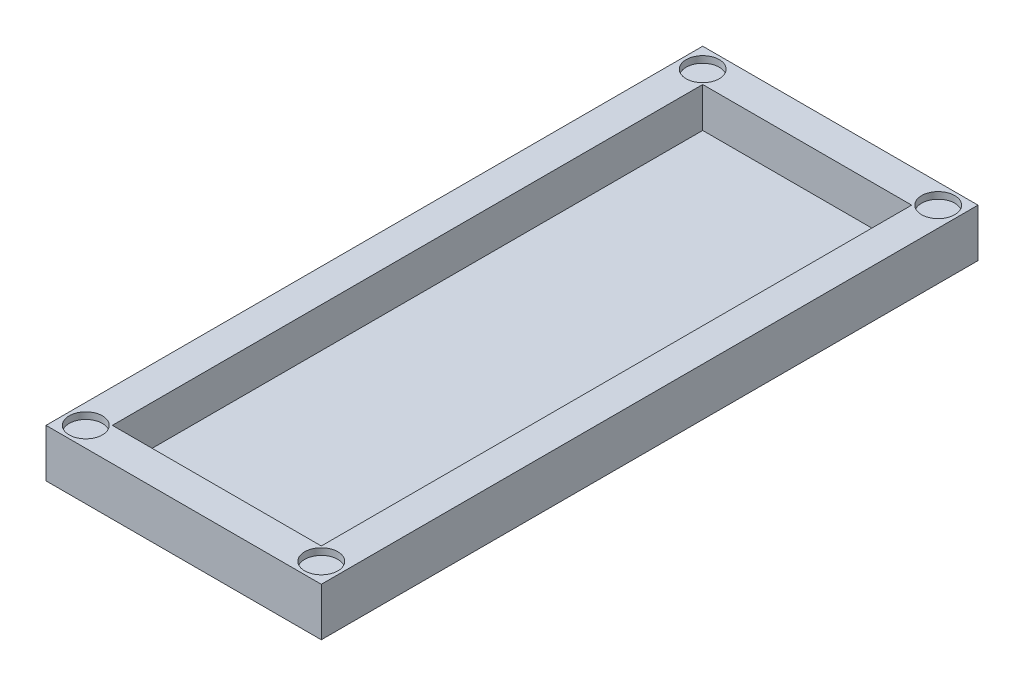
from build123d import *

# Parameters (mm, degrees)
SKETCH2_W           = 83
SKETCH2_H           = 198
BOSS_EXTRUDE5_DEPTH = 2.5
SKETCH5_W           = 83
SKETCH5_H           = 198
SKETCH5_W_2         = 63
SKETCH5_H_2         = 178
BOSS_EXTRUDE6_DEPTH = 12
SKETCH6_R           = 5
CUT_EXTRUDE1_DEPTH  = 2
CUT_EXTRUDE2_DEPTH  = 1


with BuildPart() as part:
    # Sketch2 → Boss-Extrude5 (new body)
    with BuildSketch(Plane(origin=(0, 0, 0), x_dir=(1, 0, 0), z_dir=(0, 1, 0))):
        Rectangle(SKETCH2_W, SKETCH2_H)
    extrude(amount=BOSS_EXTRUDE5_DEPTH)

    # Sketch5 → Boss-Extrude6 (add)
    with BuildSketch(Plane(origin=(0, 2.5, 0), x_dir=(1, 0, 0), z_dir=(0, 1, 0))):
        Rectangle(SKETCH5_W, SKETCH5_H)
        Rectangle(SKETCH5_W_2, SKETCH5_H_2, mode=Mode.SUBTRACT)
    extrude(amount=BOSS_EXTRUDE6_DEPTH)

    # Sketch6 → Cut-Extrude1 (cut)
    with BuildSketch(Plane(origin=(0, 14.5, 0), x_dir=(1, 0, 0), z_dir=(0, 1, 0))):
        with Locations(Location((-35.5, -93, 0), (0, 0, 270))):
            Circle(SKETCH6_R)
        with Locations(Location((35.5, -93, 0), (0, 0, 270))):
            Circle(SKETCH6_R)
        with Locations(Location((35.5, 93, 0), (0, 0, 270))):
            Circle(SKETCH6_R)
        with Locations(Location((-35.5, 93, 0), (0, 0, 270))):
            Circle(SKETCH6_R)
    extrude(amount=-CUT_EXTRUDE1_DEPTH, mode=Mode.SUBTRACT)

    # Sketch9 → Cut-Extrude2 (cut)
    # profile 1 of 11: a face of its own
    with BuildSketch(Plane(origin=(0, 0, 0), x_dir=(-1, 0, 0), z_dir=(0, -1, 0))):
        with BuildLine():
            add(Edge.make_bspline(
                [(-18.430464524, 2.48626712), (-18.370713457, 2.484254645), (-18.251432903, 2.480237158), (-18.074778774, 2.448420071), (-17.900708157, 2.398998196), (-17.790193585, 2.349468415), (-17.734307429, 2.324421681)],
                knots=[0, 0, 0, 0, 0.994543132, 1.985398125, 2.981235217, 4, 4, 4, 4], degree=3))
            add(Edge.make_bspline(
                [(-17.734307429, 2.324421681), (-17.710362074, 2.312833845), (-17.666743069, 2.291725371), (-17.605174928, 2.269965166), (-17.556628328, 2.25250433), (-17.527226937, 2.250069294), (-17.514818409, 2.249041614)],
                knots=[0, 0, 0, 0, 1.366071158, 2.488443524, 3.362064513, 4, 4, 4, 4], degree=3))
            add(Edge.make_bspline(
                [(-17.514818409, 2.249041614), (-17.506182359, 2.249384789), (-17.48660693, 2.250162667), (-17.454154031, 2.255330255), (-17.414787938, 2.261492833), (-17.386677847, 2.268276185), (-17.371448477, 2.271951242)],
                knots=[0, 0, 0, 0, 0.712600479, 1.615259286, 2.708004946, 4, 4, 4, 4], degree=3))
            add(Edge.make_bspline(
                [(-17.371448477, 2.271951242), (-17.360155353, 2.274285058), (-17.336517268, 2.279170061), (-17.312372885, 2.279282647), (-17.299763511, 2.279341445)],
                knots=[0, 0, 0, 0, 0.955502454, 2, 2, 2, 2], degree=3))
            add(Edge.make_bspline(
                [(-17.299763511, 2.279341445), (-17.278857012, 2.277969033), (-17.237296794, 2.275240803), (-17.177607751, 2.251284594), (-17.122521693, 2.212561491), (-17.091905209, 2.17783931), (-17.075840369, 2.159620161)],
                knots=[0, 0, 0, 0, 0.951755322, 1.892002987, 2.893908443, 4, 4, 4, 4], degree=3))
            add(Edge.make_bspline(
                [(-17.075840369, 2.159620161), (-17.056885764, 2.135076295), (-17.019196409, 2.086273247), (-16.971052916, 2.006861849), (-16.929546807, 1.923728168), (-16.896090334, 1.835549279), (-16.870432769, 1.743231843), (-16.851905854, 1.646357819), (-16.840677207, 1.545267841), (-16.839309265, 1.476301555), (-16.838614862, 1.441292458)],
                knots=[0, 0, 0, 0, 0.963401013, 1.91562761, 2.881430175, 3.848567728, 4.842648035, 5.856443937, 6.911874666, 8, 8, 8, 8], degree=3))
            add(Edge.make_bspline(
                [(-16.838614862, 1.441292458), (-16.839083602, 1.416873782), (-16.839987224, 1.369800261), (-16.849713575, 1.301592622), (-16.86627313, 1.238913813), (-16.887036109, 1.180184163), (-16.916738514, 1.127565987), (-16.95110397, 1.078935165), (-16.993273195, 1.036387888), (-17.025035737, 1.012290001), (-17.041106416, 1.000097357)],
                knots=[0, 0, 0, 0, 1.157178249, 2.230770136, 3.256209274, 4.228107424, 5.174189859, 6.110999593, 7.044235235, 8, 8, 8, 8], degree=3))
            add(Edge.make_bspline(
                [(-17.041106416, 1.000097357), (-17.059515893, 0.988658529), (-17.096182637, 0.965875452), (-17.156901899, 0.942353933), (-17.22097423, 0.92775087), (-17.264950047, 0.926227219), (-17.287200166, 0.925456309)],
                knots=[0, 0, 0, 0, 0.994587699, 1.980952045, 2.978437263, 4, 4, 4, 4], degree=3))
            add(Edge.make_bspline(
                [(-17.287200166, 0.925456309), (-17.307189009, 0.926225318), (-17.345198707, 0.927687622), (-17.399637153, 0.937064929), (-17.448053002, 0.95413375), (-17.49196212, 0.978381695), (-17.531654536, 1.012646649), (-17.568685712, 1.057066972), (-17.607044263, 1.11050295), (-17.629331523, 1.151312686), (-17.641190875, 1.1730281)],
                knots=[0, 0, 0, 0, 1.041577197, 1.980606666, 2.865539255, 3.704510443, 4.578768394, 5.579698629, 6.712124829, 8, 8, 8, 8], degree=3))
            add(Edge.make_bspline(
                [(-17.641190875, 1.1730281), (-17.657763947, 1.20342941), (-17.68855454, 1.259911053), (-17.733880445, 1.336899032), (-17.773182875, 1.400843725), (-17.820643816, 1.467473978), (-17.884021187, 1.538821556), (-17.942906458, 1.584803314), (-17.973010977, 1.608311039)],
                knots=[0, 0, 0, 0, 1.127566679, 2.094870931, 2.909569875, 3.570805904, 4.758098266, 6, 6, 6, 6], degree=3))
            add(Edge.make_bspline(
                [(-17.973010977, 1.608311039), (-18.012198305, 1.634244957), (-18.08835995, 1.684648235), (-18.212638042, 1.737227231), (-18.339241078, 1.77099788), (-18.425330481, 1.774877696), (-18.468154558, 1.776807661)],
                knots=[0, 0, 0, 0, 1.05923958, 2.058661118, 3.034305701, 4, 4, 4, 4], degree=3))
            add(Edge.make_bspline(
                [(-18.468154558, 1.776807661), (-18.488626424, 1.776205743), (-18.528504759, 1.775033233), (-18.586775672, 1.76688212), (-18.641813271, 1.752797688), (-18.693813412, 1.732981445), (-18.742118199, 1.706602701), (-18.787712879, 1.675461836), (-18.829757951, 1.638371814), (-18.86837409, 1.595970248), (-18.902701648, 1.549090061), (-18.932737239, 1.498120587), (-18.957676947, 1.443291269), (-18.978563945, 1.384469809), (-18.994460714, 1.321834529), (-19.006611305, 1.255462568), (-19.013021505, 1.18522718), (-19.013860914, 1.137074026), (-19.014290538, 1.112428438)],
                knots=[0, 0, 0, 0, 1.013829975, 1.974898112, 2.907031647, 3.822406359, 4.723109209, 5.626699596, 6.551779913, 7.49313013, 8.461911618, 9.424450048, 10.418036234, 11.440637793, 12.511866762, 13.61513289, 14.779385202, 16, 16, 16, 16], degree=3))
            add(Edge.make_bspline(
                [(-19.014290538, 1.112428438), (-19.013888342, 1.077907239), (-19.013093538, 1.009687699), (-19.001724561, 0.90858428), (-18.986276946, 0.809357353), (-18.961949366, 0.712562897), (-18.932870959, 0.617751611), (-18.896025661, 0.525606972), (-18.853586261, 0.435202494), (-18.819877125, 0.377360185), (-18.80293074, 0.348281478)],
                knots=[0, 0, 0, 0, 1.031247379, 2.03791365, 3.037771106, 4.030691164, 5.018108569, 5.999826826, 6.99446533, 8, 8, 8, 8], degree=3))
            add(Edge.make_bspline(
                [(-18.80293074, 0.348281478), (-18.778725863, 0.311378149), (-18.731523859, 0.239412853), (-18.646727809, 0.145274109), (-18.555639251, 0.064103565), (-18.455484387, -0.001179552), (-18.348113163, -0.053049901), (-18.232572497, -0.089048104), (-18.109328934, -0.110956879), (-18.024589042, -0.113685289), (-17.9811402, -0.115084231)],
                knots=[0, 0, 0, 0, 1.069015146, 2.084689683, 3.062672767, 4.020500115, 4.974537104, 5.945799079, 6.946745732, 8, 8, 8, 8], degree=3))
            add(Edge.make_bspline(
                [(-17.9811402, -0.115084231), (-17.948337675, -0.114171307), (-17.882499351, -0.112338966), (-17.784368483, -0.099334538), (-17.686642614, -0.078695225), (-17.591416222, -0.049216707), (-17.501022688, -0.014243503), (-17.420257299, 0.02737449), (-17.349276115, 0.072525378), (-17.309889842, 0.108989885), (-17.290895267, 0.126575397)],
                knots=[0, 0, 0, 0, 1.052954964, 2.113398045, 3.172867416, 4.256157247, 5.310655612, 6.27984414, 7.170431038, 8, 8, 8, 8], degree=3))
            add(Edge.make_bspline(
                [(-17.290895267, 0.126575397), (-17.276388853, 0.139969021), (-17.249917562, 0.164409692), (-17.210152121, 0.193092737), (-17.174056177, 0.211224599), (-17.150620852, 0.214521645), (-17.140135132, 0.21599685)],
                knots=[0, 0, 0, 0, 1.325197549, 2.418219121, 3.292260257, 4, 4, 4, 4], degree=3))
            add(Edge.make_bspline(
                [(-17.140135132, 0.21599685), (-17.126221293, 0.214949864), (-17.098571679, 0.212869292), (-17.058617294, 0.197483287), (-17.023557742, 0.170183415), (-16.992090676, 0.134809622), (-16.96604861, 0.092461206), (-16.946298067, 0.045196735), (-16.93520315, -0.006676592), (-16.933887721, -0.042608465), (-16.933209456, -0.061135751)],
                knots=[0, 0, 0, 0, 0.872623042, 1.734078476, 2.640170075, 3.636614138, 4.692130371, 5.745946442, 6.837759026, 8, 8, 8, 8], degree=3))
            add(Edge.make_bspline(
                [(-16.933209456, -0.061135751), (-16.934254316, -0.086091153), (-16.936436669, -0.13821439), (-16.953739947, -0.218111767), (-16.981692657, -0.301993182), (-17.018620727, -0.387739815), (-17.062495354, -0.471029606), (-17.111853881, -0.546790292), (-17.166015844, -0.61297254), (-17.20669107, -0.650326601), (-17.226600504, -0.668610413)],
                knots=[0, 0, 0, 0, 0.865314323, 1.807343493, 2.823606105, 3.930165877, 5.042782542, 6.085827563, 7.063063862, 8, 8, 8, 8], degree=3))
            add(Edge.make_bspline(
                [(-17.226600504, -0.668610413), (-17.237218309, -0.675919418), (-17.261711441, -0.692779815), (-17.309703633, -0.71040463), (-17.370231829, -0.729154238), (-17.415918204, -0.738743521), (-17.440916382, -0.743990481)],
                knots=[0, 0, 0, 0, 0.67377611, 1.554265273, 2.661769213, 4, 4, 4, 4], degree=3))
            add(Edge.make_bspline(
                [(-17.440916382, -0.743990481), (-17.457766121, -0.747578593), (-17.494753085, -0.755454878), (-17.552578866, -0.776567627), (-17.618811299, -0.803029525), (-17.664710815, -0.824760706), (-17.689227193, -0.836368015)],
                knots=[0, 0, 0, 0, 0.777438296, 1.706559577, 2.775001235, 4, 4, 4, 4], degree=3))
            add(Edge.make_bspline(
                [(-17.689227193, -0.836368015), (-17.719638191, -0.850468715), (-17.780058337, -0.878483791), (-17.872698274, -0.914923126), (-17.966646193, -0.944909806), (-18.061239192, -0.970418479), (-18.156846108, -0.989359651), (-18.252991897, -1.003679743), (-18.350262111, -1.011848014), (-18.415423404, -1.013102064), (-18.448201011, -1.01373288)],
                knots=[0, 0, 0, 0, 1.023278553, 2.03303558, 3.036724571, 4.032776533, 5.02247644, 6.010574797, 6.999274039, 8, 8, 8, 8], degree=3))
            add(Edge.make_bspline(
                [(-18.448201011, -1.01373288), (-18.516833816, -1.011395559), (-18.654958379, -1.006691666), (-18.861247704, -0.970072329), (-19.067646681, -0.913045672), (-19.200807173, -0.857314631), (-19.268513511, -0.828977812)],
                knots=[0, 0, 0, 0, 0.97206299, 1.956291528, 2.960862834, 4, 4, 4, 4], degree=3))
            add(Edge.make_bspline(
                [(-19.268513511, -0.828977812), (-19.307511435, -0.810630131), (-19.384796166, -0.774269336), (-19.494397315, -0.709133664), (-19.598216484, -0.637695247), (-19.695093104, -0.55806689), (-19.786499462, -0.472159047), (-19.8715721, -0.37885992), (-19.950277435, -0.278360883), (-19.996733553, -0.206600347), (-20.020097125, -0.170510751)],
                knots=[0, 0, 0, 0, 1.01921468, 2.019844185, 3.012565876, 3.998436806, 4.983876906, 5.978171524, 6.983188029, 8, 8, 8, 8], degree=3))
            add(Edge.make_bspline(
                [(-20.020097125, -0.170510751), (-20.041731575, -0.134553141), (-20.084442823, -0.063564767), (-20.140027222, 0.046186995), (-20.186870255, 0.157266366), (-20.224399957, 0.269806164), (-20.254208185, 0.383340943), (-20.275800536, 0.498129128), (-20.288552798, 0.614285752), (-20.290395594, 0.692141793), (-20.291317565, 0.731093978)],
                knots=[0, 0, 0, 0, 1.055267813, 2.083334945, 3.091415004, 4.084839949, 5.064723394, 6.041801365, 7.020292887, 8, 8, 8, 8], degree=3))
            add(Edge.make_bspline(
                [(-20.291317565, 0.731093978), (-20.290406571, 0.776225756), (-20.288598446, 0.865802493), (-20.271563904, 0.998501054), (-20.245050132, 1.128241767), (-20.208142956, 1.255215306), (-20.15963973, 1.378847035), (-20.101344203, 1.499712587), (-20.031389005, 1.617108757), (-19.977792025, 1.691705126), (-19.95062922, 1.729510364)],
                knots=[0, 0, 0, 0, 1.008024733, 2.000709278, 2.984133389, 3.964780855, 4.951173464, 5.948197717, 6.960152152, 8, 8, 8, 8], degree=3))
            add(Edge.make_bspline(
                [(-19.95062922, 1.729510364), (-19.925510593, 1.761712874), (-19.8755091, 1.825815644), (-19.791717052, 1.914251017), (-19.70370817, 1.99823275), (-19.610105102, 2.076542009), (-19.510293748, 2.14842748), (-19.4053199, 2.215068572), (-19.294489917, 2.27586087), (-19.21726075, 2.311101653), (-19.178353038, 2.328855803)],
                knots=[0, 0, 0, 0, 0.991161157, 1.973019346, 2.954622418, 3.944121643, 4.933620867, 5.939242354, 6.961799438, 8, 8, 8, 8], degree=3))
            add(Edge.make_bspline(
                [(-19.178353038, 2.328855803), (-19.117954707, 2.353084038), (-18.997884246, 2.401249198), (-18.811062293, 2.449723447), (-18.621703517, 2.481046104), (-18.494391279, 2.484521856), (-18.430464524, 2.48626712)],
                knots=[0, 0, 0, 0, 1.01399719, 2.015802553, 3.003683334, 4, 4, 4, 4], degree=3))
        make_face()
    # profile 2 of 11: a face of its own
    with BuildSketch(Plane(origin=(0, 0, 0), x_dir=(-1, 0, 0), z_dir=(0, -1, 0))):
        with BuildLine():
            add(Edge.make_bspline(
                [(-14.708019423, 2.48626712), (-14.655503598, 2.485098258), (-14.551673376, 2.482787275), (-14.398715845, 2.465441266), (-14.250722189, 2.437310543), (-14.107702657, 2.398292554), (-13.969602642, 2.347264149), (-13.837262048, 2.283516502), (-13.708381269, 2.211333013), (-13.628515764, 2.153295991), (-13.588403713, 2.124147188)],
                knots=[0, 0, 0, 0, 1.051844963, 2.079626439, 3.079387353, 4.067054608, 5.046041816, 6.023896578, 7.007511949, 8, 8, 8, 8], degree=3))
            add(Edge.make_bspline(
                [(-13.588403713, 2.124147188), (-13.56176406, 2.103050735), (-13.508329719, 2.060735056), (-13.433213531, 1.991141196), (-13.36217307, 1.916668203), (-13.293967204, 1.838729433), (-13.230328625, 1.755183531), (-13.169730466, 1.667651433), (-13.11341533, 1.574998696), (-13.079390148, 1.510692118), (-13.062221281, 1.478243472)],
                knots=[0, 0, 0, 0, 0.970644245, 1.946937291, 2.922621233, 3.910516206, 4.904410596, 5.921583779, 6.951245804, 8, 8, 8, 8], degree=3))
            add(Edge.make_bspline(
                [(-13.062221281, 1.478243472), (-13.046566706, 1.445650153), (-13.015499705, 1.380967675), (-12.976104918, 1.282049313), (-12.941631593, 1.183287248), (-12.91363655, 1.084611585), (-12.891840452, 0.985925326), (-12.877582427, 0.887081081), (-12.867130707, 0.788467071), (-12.866136219, 0.722499369), (-12.865641889, 0.689708843)],
                knots=[0, 0, 0, 0, 1.058036634, 2.099707382, 3.114403172, 4.118670422, 5.100161022, 6.069901926, 7.04060732, 8, 8, 8, 8], degree=3))
            add(Edge.make_bspline(
                [(-12.865641889, 0.689708843), (-12.866685607, 0.641855152), (-12.868754129, 0.547014963), (-12.888110517, 0.406832699), (-12.918128548, 0.27051083), (-12.960679365, 0.137911024), (-13.015252643, 0.009082321), (-13.083317169, -0.115363339), (-13.162240244, -0.23658529), (-13.223387009, -0.312413775), (-13.254366551, -0.350831697)],
                knots=[0, 0, 0, 0, 1.011547597, 2.004764173, 2.986864892, 3.960583769, 4.945650878, 5.941037557, 6.956842404, 8, 8, 8, 8], degree=3))
            add(Edge.make_bspline(
                [(-13.254366551, -0.350831697), (-13.282497531, -0.382536898), (-13.338623668, -0.445794218), (-13.430589358, -0.532980728), (-13.528896333, -0.613144895), (-13.632981171, -0.687289309), (-13.744177172, -0.754017794), (-13.862257423, -0.812578932), (-13.985420196, -0.866651614), (-14.071235185, -0.895630729), (-14.114586146, -0.910270042)],
                knots=[0, 0, 0, 0, 0.977965172, 1.951208449, 2.920924385, 3.903769687, 4.898369367, 5.910384584, 6.944393771, 8, 8, 8, 8], degree=3))
            add(Edge.make_bspline(
                [(-14.114586146, -0.910270042), (-14.168813108, -0.926146374), (-14.276570302, -0.957695053), (-14.440977587, -0.98971982), (-14.605537933, -1.009696807), (-14.715353703, -1.012390211), (-14.770097125, -1.01373288)],
                knots=[0, 0, 0, 0, 1.017501807, 2.021930326, 3.013927564, 4, 4, 4, 4], degree=3))
            add(Edge.make_bspline(
                [(-14.770097125, -1.01373288), (-14.805829769, -1.013102345), (-14.876892859, -1.011848373), (-14.983010996, -1.003670674), (-15.087789594, -0.989442837), (-15.191733428, -0.970405731), (-15.294261883, -0.945073449), (-15.395972564, -0.91478212), (-15.496378496, -0.87870342), (-15.561971227, -0.850501645), (-15.594843747, -0.836368015)],
                knots=[0, 0, 0, 0, 1.009055621, 2.006753535, 3.003359543, 3.993901918, 4.989341907, 5.984125409, 6.989722224, 8, 8, 8, 8], degree=3))
            add(Edge.make_bspline(
                [(-15.594843747, -0.836368015), (-15.633848616, -0.81803209), (-15.711147109, -0.781694591), (-15.820232028, -0.716634436), (-15.923799365, -0.646320713), (-16.020862004, -0.568945739), (-16.110120128, -0.483226773), (-16.194219442, -0.392016808), (-16.272222978, -0.294110537), (-16.317688962, -0.223631367), (-16.3405152, -0.188247238)],
                knots=[0, 0, 0, 0, 1.030857394, 2.04291731, 3.035438857, 4.025155278, 5.009237461, 5.993884518, 6.992827961, 8, 8, 8, 8], degree=3))
            add(Edge.make_bspline(
                [(-16.3405152, -0.188247238), (-16.361471616, -0.153055212), (-16.403066456, -0.083205161), (-16.456188726, 0.026086744), (-16.501587467, 0.137552197), (-16.537600467, 0.252154911), (-16.56668047, 0.369068612), (-16.587499863, 0.489062416), (-16.599207966, 0.611877728), (-16.6011504, 0.694612089), (-16.602128375, 0.73626712)],
                knots=[0, 0, 0, 0, 1.009325406, 2.00333536, 2.992305541, 3.973695717, 4.961975817, 5.960335459, 6.973071281, 8, 8, 8, 8], degree=3))
            add(Edge.make_bspline(
                [(-16.602128375, 0.73626712), (-16.601155595, 0.784590382), (-16.599239605, 0.879767958), (-16.583401054, 1.020438998), (-16.556760933, 1.156565029), (-16.519795694, 1.288584495), (-16.472172002, 1.416311734), (-16.414574202, 1.539735212), (-16.346425207, 1.659172623), (-16.29290539, 1.733894675), (-16.265874152, 1.771634519)],
                knots=[0, 0, 0, 0, 1.046408287, 2.061007504, 3.06133757, 4.047798165, 5.026959698, 6.010371128, 6.995098758, 8, 8, 8, 8], degree=3))
            add(Edge.make_bspline(
                [(-16.265874152, 1.771634519), (-16.24027604, 1.804340754), (-16.189424685, 1.869312592), (-16.104080861, 1.958970448), (-16.013228278, 2.04272397), (-15.915593152, 2.119885381), (-15.810733373, 2.189079052), (-15.700434938, 2.253008225), (-15.583441744, 2.310279031), (-15.501723323, 2.342234655), (-15.460342058, 2.358416614)],
                knots=[0, 0, 0, 0, 0.985888601, 1.958494869, 2.935682924, 3.91884238, 4.910270308, 5.916774205, 6.945078517, 8, 8, 8, 8], degree=3))
            add(Edge.make_bspline(
                [(-15.460342058, 2.358416614), (-15.402555196, 2.378353015), (-15.285612061, 2.418698262), (-15.10083911, 2.457445156), (-14.907471141, 2.481677249), (-14.775346673, 2.484717756), (-14.708019423, 2.48626712)],
                knots=[0, 0, 0, 0, 0.955506866, 1.933656958, 2.94704443, 4, 4, 4, 4], degree=3))
        make_face()
        with BuildLine():
            add(Edge.make_bspline(
                [(-14.920857261, 1.776807661), (-14.936920263, 1.776284843), (-14.968559776, 1.775255043), (-15.014609352, 1.765742461), (-15.058785608, 1.752291455), (-15.099467274, 1.730986084), (-15.137785043, 1.704808336), (-15.17337703, 1.672826095), (-15.206168874, 1.63466008), (-15.225146181, 1.606069786), (-15.234940875, 1.591313573)],
                knots=[0, 0, 0, 0, 1.006775924, 1.983060122, 2.941306894, 3.895429469, 4.851678852, 5.847954811, 6.889272089, 8, 8, 8, 8], degree=3))
            add(Edge.make_bspline(
                [(-15.234940875, 1.591313573), (-15.248817064, 1.567563279), (-15.276835188, 1.519607845), (-15.304277292, 1.439146144), (-15.321855468, 1.352639784), (-15.323998858, 1.292595422), (-15.325101348, 1.261710532)],
                knots=[0, 0, 0, 0, 0.951288008, 1.920794309, 2.930523426, 4, 4, 4, 4], degree=3))
            add(Edge.make_bspline(
                [(-15.325101348, 1.261710532), (-15.323767006, 1.213115541), (-15.320985762, 1.111826248), (-15.298683612, 0.955047354), (-15.26434009, 0.787323827), (-15.217691504, 0.61221419), (-15.161267109, 0.43646415), (-15.096412754, 0.267816163), (-15.024105499, 0.109543895), (-14.969258286, 0.00998828), (-14.942288848, -0.038965143)],
                knots=[0, 0, 0, 0, 0.851887102, 1.775636513, 2.771927568, 3.853257604, 4.951607259, 6.007335301, 7.020168178, 8, 8, 8, 8], degree=3))
            add(Edge.make_bspline(
                [(-14.942288848, -0.038965143), (-14.929593386, -0.058433245), (-14.904659668, -0.096668336), (-14.861659189, -0.148820758), (-14.813827131, -0.194194278), (-14.762747689, -0.233277376), (-14.708677419, -0.264229788), (-14.654079515, -0.287662062), (-14.598354826, -0.301655847), (-14.561028745, -0.30340443), (-14.542478882, -0.30427342)],
                knots=[0, 0, 0, 0, 1.113912043, 2.187708353, 3.232060128, 4.269172407, 5.263986051, 6.211680872, 7.111262858, 8, 8, 8, 8], degree=3))
            add(Edge.make_bspline(
                [(-14.542478882, -0.30427342), (-14.51366307, -0.302725429), (-14.457653493, -0.299716582), (-14.378676073, -0.271602704), (-14.308330303, -0.226909076), (-14.249710187, -0.163599509), (-14.20159705, -0.087155036), (-14.166649655, 0.001738825), (-14.14594377, 0.101730085), (-14.143789192, 0.172045837), (-14.142668916, 0.208606647)],
                knots=[0, 0, 0, 0, 0.946251944, 1.839239202, 2.726048847, 3.66727789, 4.655527083, 5.686138377, 6.796903217, 8, 8, 8, 8], degree=3))
            add(Edge.make_bspline(
                [(-14.142668916, 0.208606647), (-14.143923333, 0.259640512), (-14.146487102, 0.363943237), (-14.164170736, 0.522978371), (-14.193314406, 0.687795529), (-14.233499396, 0.855222755), (-14.281958893, 1.019656636), (-14.337676621, 1.174498338), (-14.401153257, 1.31649011), (-14.449982624, 1.404410129), (-14.473749997, 1.44720462)],
                knots=[0, 0, 0, 0, 0.945659483, 1.932733523, 2.961681864, 4.04567364, 5.121744827, 6.13695095, 7.093173116, 8, 8, 8, 8], degree=3))
            add(Edge.make_bspline(
                [(-14.473749997, 1.44720462), (-14.4888071, 1.471416849), (-14.518136638, 1.518579537), (-14.568798235, 1.582362802), (-14.62280993, 1.638351724), (-14.680343063, 1.685326625), (-14.739176701, 1.724348219), (-14.799416957, 1.75258561), (-14.859920351, 1.771447436), (-14.900779955, 1.77504159), (-14.920857261, 1.776807661)],
                knots=[0, 0, 0, 0, 1.183501978, 2.305328301, 3.376255037, 4.408653338, 5.384967338, 6.300458299, 7.164891106, 8, 8, 8, 8], degree=3))
        make_face(mode=Mode.SUBTRACT)
    # profile 3 of 11: a face of its own
    with BuildSketch(Plane(origin=(0, 0, 0), x_dir=(-1, 0, 0), z_dir=(0, -1, 0))):
        with BuildLine():
            Line((-10.452740706, 1.551406478), (-10.525164693, 1.725076242))
            add(Edge.make_bspline(
                [(-10.525164693, 1.725076242), (-10.536338, 1.754823038), (-10.556892006, 1.809544154), (-10.598095998, 1.879456796), (-10.642353295, 1.933607217), (-10.67894574, 1.955245173), (-10.695878375, 1.96525783)],
                knots=[0, 0, 0, 0, 1.26120691, 2.320069966, 3.222636208, 4, 4, 4, 4], degree=3))
            add(Edge.make_bspline(
                [(-10.695878375, 1.96525783), (-10.710330399, 1.972608245), (-10.737947468, 1.986654507), (-10.775154473, 2.011415087), (-10.807288295, 2.036978621), (-10.833201075, 2.064461352), (-10.854178203, 2.092935624), (-10.867803624, 2.123552737), (-10.877643054, 2.155324956), (-10.878645657, 2.177279681), (-10.879155402, 2.188441951)],
                knots=[0, 0, 0, 0, 1.274788197, 2.436054187, 3.510778093, 4.498034506, 5.401631632, 6.277568582, 7.124277557, 8, 8, 8, 8], degree=3))
            add(Edge.make_bspline(
                [(-10.879155402, 2.188441951), (-10.878490908, 2.20060738), (-10.877186477, 2.224488645), (-10.865239048, 2.259116192), (-10.845827348, 2.291090817), (-10.818073884, 2.320185919), (-10.784016179, 2.347634472), (-10.741899491, 2.372165031), (-10.692052944, 2.392764116), (-10.635502498, 2.413131507), (-10.571273869, 2.430679048), (-10.499042131, 2.444927693), (-10.419778889, 2.458504711), (-10.332667842, 2.468500813), (-10.238276275, 2.476505299), (-10.136264934, 2.482583326), (-10.026583895, 2.48506329), (-9.950946324, 2.485856409), (-9.911777869, 2.48626712)],
                knots=[0, 0, 0, 0, 0.536799426, 1.053760572, 1.601403313, 2.179845644, 2.823226354, 3.531628717, 4.327293706, 5.20629658, 6.18988224, 7.269273785, 8.462547327, 9.746767792, 11.146917289, 12.653435066, 14.267001753, 16, 16, 16, 16], degree=3))
            add(Edge.make_bspline(
                [(-9.911777869, 2.48626712), (-9.872611544, 2.485826316), (-9.796978087, 2.484975086), (-9.687007451, 2.482894115), (-9.584345012, 2.475358274), (-9.4885828, 2.468235978), (-9.400257525, 2.456351346), (-9.318840944, 2.444851108), (-9.245027118, 2.428241422), (-9.198578702, 2.415485417), (-9.1764527, 2.409409012)],
                knots=[0, 0, 0, 0, 1.267529621, 2.447705987, 3.558030398, 4.597996478, 5.554081833, 6.441329293, 7.257517179, 8, 8, 8, 8], degree=3))
            add(Edge.make_bspline(
                [(-9.1764527, 2.409409012), (-9.162751751, 2.404598452), (-9.135826571, 2.395144714), (-9.099008543, 2.375164112), (-9.066384097, 2.351030871), (-9.038786489, 2.32316367), (-9.015546848, 2.293163806), (-8.998816678, 2.260689755), (-8.988862549, 2.226474292), (-8.987794154, 2.203038152), (-8.987263511, 2.191398032)],
                knots=[0, 0, 0, 0, 1.127531642, 2.215831273, 3.24238639, 4.271617853, 5.256038844, 6.181102948, 7.096601288, 8, 8, 8, 8], degree=3))
            add(Edge.make_bspline(
                [(-8.987263511, 2.191398032), (-8.988072799, 2.172999722), (-8.989520268, 2.140093074), (-9.005408671, 2.100625348), (-9.02901684, 2.073556202), (-9.055978774, 2.046298781), (-9.092973059, 2.011087078), (-9.121000717, 1.984935394), (-9.136545605, 1.970430972)],
                knots=[0, 0, 0, 0, 1.190259691, 2.12886165, 2.685812979, 3.511347902, 4.61972704, 6, 6, 6, 6], degree=3))
            add(Edge.make_bspline(
                [(-9.136545605, 1.970430972), (-9.145444085, 1.962069517), (-9.162325933, 1.946206491), (-9.182129264, 1.919591174), (-9.194159875, 1.891319634), (-9.195667716, 1.871997745), (-9.196406247, 1.862534012)],
                knots=[0, 0, 0, 0, 1.150053324, 2.181836378, 3.10947558, 4, 4, 4, 4], degree=3))
            add(Edge.make_bspline(
                [(-9.196406247, 1.862534012), (-9.195235443, 1.845685983), (-9.192523382, 1.80665905), (-9.172543985, 1.742255619), (-9.146931339, 1.662079764), (-9.122562198, 1.604916665), (-9.109201855, 1.573577087)],
                knots=[0, 0, 0, 0, 0.666352318, 1.543544816, 2.653252321, 4, 4, 4, 4], degree=3))
            Line((-9.109201855, 1.573577087), (-8.978395267, 1.266144654))
            add(Edge.make_bspline(
                [(-8.978395267, 1.266144654), (-8.963510966, 1.234793497), (-8.936531372, 1.177965735), (-8.898496861, 1.10268696), (-8.867272498, 1.046385185), (-8.843553829, 1.005608557), (-8.820257712, 0.97879095), (-8.797395177, 0.960563873), (-8.772444635, 0.949076709), (-8.755078635, 0.947620449), (-8.746342902, 0.946887897)],
                knots=[0, 0, 0, 0, 2.027772553, 3.675582807, 4.925337159, 5.791885889, 6.424177819, 6.988433472, 7.491145064, 8, 8, 8, 8], degree=3))
            add(Edge.make_bspline(
                [(-8.746342902, 0.946887897), (-8.736799274, 0.947424133), (-8.717790297, 0.948492206), (-8.691723028, 0.962962964), (-8.667520534, 0.983219536), (-8.645190659, 1.01378602), (-8.623318384, 1.055981782), (-8.598084953, 1.111969193), (-8.570458453, 1.183663548), (-8.551813222, 1.237017365), (-8.541634288, 1.266144654)],
                knots=[0, 0, 0, 0, 0.567355855, 1.130057995, 1.749835203, 2.457435075, 3.384829485, 4.603795269, 6.145920152, 8, 8, 8, 8], degree=3))
            Line((-8.541634288, 1.266144654), (-8.421913004, 1.613484181))
            add(Edge.make_bspline(
                [(-8.421913004, 1.613484181), (-8.414546723, 1.635590505), (-8.400962812, 1.676356036), (-8.385282904, 1.733756904), (-8.374569483, 1.782079046), (-8.373063403, 1.811748438), (-8.372398646, 1.824843978)],
                knots=[0, 0, 0, 0, 1.283049029, 2.366027745, 3.278793834, 4, 4, 4, 4], degree=3))
            add(Edge.make_bspline(
                [(-8.372398646, 1.824843978), (-8.373585795, 1.839373976), (-8.375904517, 1.867753759), (-8.397274161, 1.906547072), (-8.434338166, 1.934672931), (-8.464142232, 1.945880905), (-8.480295605, 1.951955465)],
                knots=[0, 0, 0, 0, 0.964050136, 1.882969018, 2.852599809, 4, 4, 4, 4], degree=3))
            add(Edge.make_bspline(
                [(-8.480295605, 1.951955465), (-8.497940089, 1.957974944), (-8.531447849, 1.969406237), (-8.577184226, 1.991817069), (-8.616283088, 2.017372112), (-8.647522098, 2.047749168), (-8.673523722, 2.079907639), (-8.690655608, 2.116738424), (-8.701399033, 2.156545922), (-8.702772403, 2.184428128), (-8.703479727, 2.198788235)],
                knots=[0, 0, 0, 0, 1.244276815, 2.362943996, 3.394455147, 4.348922122, 5.26398862, 6.139891995, 7.041992967, 8, 8, 8, 8], degree=3))
            add(Edge.make_bspline(
                [(-8.703479727, 2.198788235), (-8.70320054, 2.211158593), (-8.702652308, 2.235449875), (-8.69408181, 2.270029555), (-8.681322606, 2.302386917), (-8.662923592, 2.331590462), (-8.639254487, 2.358044743), (-8.6109888, 2.381832216), (-8.577308181, 2.402526823), (-8.538237132, 2.420279644), (-8.493324871, 2.435531958), (-8.442174551, 2.450008145), (-8.383885706, 2.46016266), (-8.319398529, 2.470127581), (-8.248353594, 2.477322825), (-8.170692067, 2.482112655), (-8.086441559, 2.486320543), (-8.028021242, 2.486285368), (-7.997715369, 2.48626712)],
                knots=[0, 0, 0, 0, 0.703062421, 1.380581478, 2.016553528, 2.678630622, 3.33487959, 4.032173918, 4.776082253, 5.57994236, 6.472195284, 7.47672628, 8.605381787, 9.84007175, 11.194819052, 12.671871152, 14.273514168, 16, 16, 16, 16], degree=3))
            add(Edge.make_bspline(
                [(-7.997715369, 2.48626712), (-7.959021047, 2.485486843), (-7.886181888, 2.48401803), (-7.783481514, 2.475156336), (-7.694393399, 2.458169958), (-7.641107056, 2.440007458), (-7.616380909, 2.43157962)],
                knots=[0, 0, 0, 0, 1.19904627, 2.257114694, 3.19125923, 4, 4, 4, 4], degree=3))
            add(Edge.make_bspline(
                [(-7.616380909, 2.43157962), (-7.60142305, 2.425291032), (-7.572702206, 2.413216205), (-7.533869422, 2.389872338), (-7.500549904, 2.364391912), (-7.472929409, 2.335744986), (-7.452294073, 2.303704848), (-7.437288194, 2.269281271), (-7.427945204, 2.232040575), (-7.426961797, 2.206235185), (-7.4264527, 2.192876073)],
                knots=[0, 0, 0, 0, 1.191518317, 2.287854934, 3.320256395, 4.268199367, 5.197448918, 6.1058178, 7.019406719, 8, 8, 8, 8], degree=3))
            add(Edge.make_bspline(
                [(-7.4264527, 2.192876073), (-7.42768575, 2.170153886), (-7.430068856, 2.126238926), (-7.454043528, 2.074954976), (-7.48275512, 2.037092315), (-7.512257072, 2.004046778), (-7.551185382, 1.967214421), (-7.580543399, 1.94196685), (-7.596427362, 1.928306816)],
                knots=[0, 0, 0, 0, 1.245005409, 2.406210364, 3.047327659, 3.8651028, 4.844927862, 6, 6, 6, 6], degree=3))
            add(Edge.make_bspline(
                [(-7.596427362, 1.928306816), (-7.617188612, 1.909603613), (-7.657040856, 1.873701892), (-7.696752165, 1.816843081), (-7.724212168, 1.761452692), (-7.749031782, 1.70325864), (-7.779102113, 1.628359574), (-7.800036449, 1.572396775), (-7.811482261, 1.541799215)],
                knots=[0, 0, 0, 0, 1.119269065, 2.148492204, 2.759013863, 3.600728486, 4.688202571, 6, 6, 6, 6], degree=3))
            Line((-7.811482261, 1.541799215), (-8.228289693, 0.381537391))
            add(Edge.make_bspline(
                [(-8.228289693, 0.381537391), (-8.241116103, 0.348534285), (-8.266089755, 0.284275615), (-8.302171318, 0.190615995), (-8.336278394, 0.102127691), (-8.368879997, 0.01899341), (-8.398912109, -0.059543252), (-8.428012918, -0.13250055), (-8.454324586, -0.200703431), (-8.479724038, -0.263314142), (-8.502372311, -0.321161491), (-8.523959376, -0.37347022), (-8.543239013, -0.420740302), (-8.559943504, -0.463086829), (-8.575956835, -0.499977023), (-8.588608167, -0.532380589), (-8.600766182, -0.558985715), (-8.629638573, -0.623926908), (-8.678198522, -0.72331275), (-8.730291484, -0.811783048), (-8.755211146, -0.854104501)],
                knots=[0, 0, 0, 0, 1.421642673, 2.768008259, 4.029872038, 5.229254812, 6.353357853, 7.405772461, 8.382897633, 9.288365855, 10.118533477, 10.877089748, 11.56033325, 12.168267021, 12.704647304, 13.174843934, 13.564490767, 13.878820873, 16.02855541, 18, 18, 18, 18], degree=3))
            add(Edge.make_bspline(
                [(-8.755211146, -0.854104501), (-8.764870291, -0.867782462), (-8.783387884, -0.894004544), (-8.813282054, -0.92988179), (-8.847192749, -0.956767137), (-8.881839013, -0.979565745), (-8.921090237, -0.995142962), (-8.965072114, -1.006041634), (-9.014904109, -1.01263284), (-9.050059239, -1.013353639), (-9.06855574, -1.01373288)],
                knots=[0, 0, 0, 0, 1.084416369, 2.078939747, 3.007897823, 3.874991178, 4.75445869, 5.725176289, 6.803125492, 8, 8, 8, 8], degree=3))
            add(Edge.make_bspline(
                [(-9.06855574, -1.01373288), (-9.09323612, -1.012839899), (-9.140194106, -1.011140873), (-9.207305719, -0.999507075), (-9.266829428, -0.978982162), (-9.319692791, -0.949492735), (-9.365742282, -0.909543254), (-9.407336728, -0.859657106), (-9.445962942, -0.799737584), (-9.466495015, -0.754400744), (-9.47723395, -0.730688116)],
                knots=[0, 0, 0, 0, 1.108272326, 2.10864809, 3.046316585, 3.923146037, 4.809899164, 5.767457071, 6.832308148, 8, 8, 8, 8], degree=3))
            Line((-9.47723395, -0.730688116), (-9.973855571, 0.436963911))
            add(Edge.make_bspline(
                [(-9.973855571, 0.436963911), (-9.979889666, 0.451797433), (-9.990741207, 0.478473611), (-10.006908045, 0.513547148), (-10.020973602, 0.539369851), (-10.034691755, 0.562217607), (-10.056744869, 0.581631975), (-10.07813311, 0.583214393), (-10.089142734, 0.584028945)],
                knots=[0, 0, 0, 0, 1.449023839, 2.605882629, 3.493679818, 4.105815713, 5.024966227, 6, 6, 6, 6], degree=3))
            add(Edge.make_bspline(
                [(-10.089142734, 0.584028945), (-10.097653356, 0.583349638), (-10.115024134, 0.581963125), (-10.139566085, 0.568989721), (-10.161038799, 0.547990329), (-10.177561268, 0.525089238), (-10.190888642, 0.500778786), (-10.203008569, 0.475913606), (-10.218177967, 0.445304949), (-10.235008815, 0.40826657), (-10.254074293, 0.365195109), (-10.274718376, 0.315694495), (-10.298573745, 0.260808221), (-10.314389019, 0.221701002), (-10.322673139, 0.201216445)],
                knots=[0, 0, 0, 0, 0.654278619, 1.335428623, 2.089804176, 2.961852438, 3.507370781, 4.231092661, 5.099600653, 6.14742242, 7.3749402, 8.739898359, 10.292342368, 12, 12, 12, 12], degree=3))
            Line((-10.322673139, 0.201216445), (-10.664839524, -0.636093522))
            add(Edge.make_bspline(
                [(-10.664839524, -0.636093522), (-10.679892027, -0.671287845), (-10.707643741, -0.736174249), (-10.752435809, -0.822559155), (-10.79593462, -0.890154493), (-10.841323388, -0.94039353), (-10.892957617, -0.97541611), (-10.953540991, -0.997572208), (-11.024317269, -1.011947567), (-11.075159119, -1.013110935), (-11.102339524, -1.01373288)],
                knots=[0, 0, 0, 0, 1.459965891, 2.691682254, 3.708235155, 4.519411335, 5.257082246, 6.063398588, 6.964679444, 8, 8, 8, 8], degree=3))
            add(Edge.make_bspline(
                [(-11.102339524, -1.01373288), (-11.127045557, -1.013028146), (-11.174195075, -1.011683216), (-11.241002622, -0.997569906), (-11.299643819, -0.973831797), (-11.351455095, -0.940067136), (-11.39722419, -0.893625478), (-11.437543129, -0.832980324), (-11.479131304, -0.760515418), (-11.501369433, -0.705405191), (-11.513234794, -0.676000616)],
                knots=[0, 0, 0, 0, 1.028693485, 1.96318051, 2.828904341, 3.651984682, 4.523293102, 5.526034128, 6.679992506, 8, 8, 8, 8], degree=3))
            Line((-11.513234794, -0.676000616), (-12.43183699, 1.657825397))
            add(Edge.make_bspline(
                [(-12.43183699, 1.657825397), (-12.440468997, 1.682787482), (-12.455678757, 1.726771154), (-12.478412904, 1.783211017), (-12.494390296, 1.822733881), (-12.509079938, 1.849365944), (-12.530032714, 1.866685624), (-12.557530176, 1.885857315), (-12.59691001, 1.908259788), (-12.627128952, 1.92399146), (-12.643935808, 1.932740938)],
                knots=[0, 0, 0, 0, 1.735951012, 3.058778965, 3.994159582, 4.546756123, 5.028117601, 5.760253759, 6.754321258, 8, 8, 8, 8], degree=3))
            add(Edge.make_bspline(
                [(-12.643935808, 1.932740938), (-12.663265509, 1.943974752), (-12.700716662, 1.965740184), (-12.742131421, 2.016280263), (-12.767009821, 2.077688442), (-12.769655355, 2.122173235), (-12.771047294, 2.145578776)],
                knots=[0, 0, 0, 0, 1.017024474, 1.970477356, 2.932172733, 4, 4, 4, 4], degree=3))
            add(Edge.make_bspline(
                [(-12.771047294, 2.145578776), (-12.770336947, 2.159451052), (-12.76894621, 2.186610559), (-12.757928257, 2.225801019), (-12.741138849, 2.262942135), (-12.71515801, 2.295916666), (-12.683518251, 2.32693928), (-12.644808701, 2.354826651), (-12.599012505, 2.379959158), (-12.546567825, 2.402692667), (-12.48698114, 2.422670326), (-12.42038456, 2.439135935), (-12.346982739, 2.45421695), (-12.266707535, 2.465416287), (-12.179515483, 2.475381528), (-12.085317896, 2.481731034), (-11.984018871, 2.485289037), (-11.914279477, 2.485934313), (-11.878310808, 2.48626712)],
                knots=[0, 0, 0, 0, 0.638602024, 1.250271829, 1.865097303, 2.505716395, 3.172389072, 3.903927958, 4.697149355, 5.577115651, 6.536145999, 7.591257307, 8.738458043, 9.989793408, 11.326907056, 12.784374661, 14.341514636, 16, 16, 16, 16], degree=3))
            add(Edge.make_bspline(
                [(-11.878310808, 2.48626712), (-11.841605155, 2.486177504), (-11.770643913, 2.486004254), (-11.668365689, 2.483221346), (-11.573796071, 2.477626504), (-11.487146537, 2.471972257), (-11.408470822, 2.461420391), (-11.337447476, 2.452108432), (-11.274594939, 2.438723036), (-11.235807345, 2.427821285), (-11.217626686, 2.422711377)],
                knots=[0, 0, 0, 0, 1.323083421, 2.557852448, 3.687267559, 4.738098217, 5.686383091, 6.547837182, 7.319337112, 8, 8, 8, 8], degree=3))
            add(Edge.make_bspline(
                [(-11.217626686, 2.422711377), (-11.202147659, 2.417264369), (-11.172286054, 2.406756189), (-11.132431281, 2.384051755), (-11.097459434, 2.358998057), (-11.068860191, 2.329117735), (-11.047296255, 2.294788201), (-11.032488632, 2.256601311), (-11.022355078, 2.21507935), (-11.021492054, 2.185796442), (-11.021047294, 2.170705465)],
                knots=[0, 0, 0, 0, 1.137725096, 2.194859936, 3.173747589, 4.117913958, 5.048489996, 5.970053361, 6.953864952, 8, 8, 8, 8], degree=3))
            add(Edge.make_bspline(
                [(-11.021047294, 2.170705465), (-11.021489412, 2.15396943), (-11.022252662, 2.125077154), (-11.029135672, 2.089528492), (-11.044454809, 2.064508975), (-11.06196276, 2.038963577), (-11.088551774, 2.005895471), (-11.108283067, 1.98079675), (-11.11933699, 1.96673587)],
                knots=[0, 0, 0, 0, 1.293028321, 2.23222112, 2.733727842, 3.5393027, 4.621460833, 6, 6, 6, 6], degree=3))
            add(Edge.make_bspline(
                [(-11.11933699, 1.96673587), (-11.129682145, 1.949966861), (-11.150788995, 1.91575365), (-11.153452122, 1.875611158), (-11.154809963, 1.855143809)],
                knots=[0, 0, 0, 0, 0.980265164, 2, 2, 2, 2], degree=3))
            add(Edge.make_bspline(
                [(-11.154809963, 1.855143809), (-11.15429713, 1.8442806), (-11.15311136, 1.819162762), (-11.144989188, 1.777435875), (-11.13208668, 1.727048247), (-11.114807691, 1.667730102), (-11.093693657, 1.59929307), (-11.066735069, 1.522274537), (-11.034822357, 1.436679855), (-11.01174492, 1.37672916), (-10.999615706, 1.345219823)],
                knots=[0, 0, 0, 0, 0.48762035, 1.127472441, 1.902461197, 2.822820275, 3.899918042, 5.11674816, 6.484598827, 8, 8, 8, 8], degree=3))
            Line((-10.999615706, 1.345219823), (-10.904282092, 1.104299215))
            add(Edge.make_bspline(
                [(-10.904282092, 1.104299215), (-10.894518027, 1.081841412), (-10.877063359, 1.041694864), (-10.852758739, 0.988933279), (-10.833670344, 0.950981594), (-10.817757788, 0.92028224), (-10.79289791, 0.896418983), (-10.768826086, 0.893630696), (-10.756478038, 0.892200397)],
                knots=[0, 0, 0, 0, 1.622110045, 2.899754755, 3.848475101, 4.433442183, 5.196407758, 6, 6, 6, 6], degree=3))
            add(Edge.make_bspline(
                [(-10.756478038, 0.892200397), (-10.748225119, 0.893219517), (-10.730618892, 0.895393638), (-10.704614856, 0.909181858), (-10.679884122, 0.932236335), (-10.654789971, 0.962973435), (-10.629439459, 1.002062699), (-10.60494605, 1.050124995), (-10.5797452, 1.1066955), (-10.563897837, 1.147577359), (-10.555464524, 1.169332999)],
                knots=[0, 0, 0, 0, 0.554845891, 1.183671233, 1.933751375, 2.81485255, 3.842607944, 5.056073934, 6.433363919, 8, 8, 8, 8], degree=3))
            Line((-10.555464524, 1.169332999), (-10.452740706, 1.452377762))
            add(Edge.make_bspline(
                [(-10.452740706, 1.452377762), (-10.449000899, 1.461112093), (-10.442497491, 1.476300823), (-10.440869269, 1.492704411), (-10.440177362, 1.499675059)],
                knots=[0, 0, 0, 0, 1.150106802, 2, 2, 2, 2], degree=3))
            add(Edge.make_bspline(
                [(-10.440177362, 1.499675059), (-10.440849674, 1.507383263), (-10.44240622, 1.525229397), (-10.448996779, 1.541923173), (-10.452740706, 1.551406478)],
                knots=[0, 0, 0, 0, 0.863851429, 2, 2, 2, 2], degree=3))
        make_face()
    # profile 4 of 11: a face of its own
    with BuildSketch(Plane(origin=(0, 0, 0), x_dir=(-1, 0, 0), z_dir=(0, -1, 0))):
        with BuildLine():
            add(Edge.make_bspline(
                [(-7.035510977, 0.870768809), (-7.013815047, 0.870607539), (-6.969111728, 0.870275251), (-6.924637692, 0.865722014), (-6.901748308, 0.863378607)],
                knots=[0, 0, 0, 0, 0.970663066, 2, 2, 2, 2], degree=3))
            add(Edge.make_bspline(
                [(-6.901748308, 0.863378607), (-6.85397135, 0.858560843), (-6.764386288, 0.849527208), (-6.639015741, 0.838927968), (-6.531561903, 0.832655595), (-6.465978757, 0.831422337), (-6.436165538, 0.830861715)],
                knots=[0, 0, 0, 0, 1.234188689, 2.314188182, 3.233652544, 4, 4, 4, 4], degree=3))
            add(Edge.make_bspline(
                [(-6.436165538, 0.830861715), (-6.410792085, 0.831007729), (-6.363728773, 0.831278559), (-6.298628582, 0.833085674), (-6.244894016, 0.837452043), (-6.212969903, 0.841601482), (-6.198940031, 0.843425059)],
                knots=[0, 0, 0, 0, 1.280635831, 2.375355318, 3.286008104, 4, 4, 4, 4], degree=3))
            add(Edge.make_bspline(
                [(-6.198940031, 0.843425059), (-6.185874505, 0.845077956), (-6.162198098, 0.848073216), (-6.130306485, 0.853076116), (-6.105608287, 0.855268514), (-6.091537631, 0.855781694), (-6.085869929, 0.855988404)],
                knots=[0, 0, 0, 0, 1.388301772, 2.515780723, 3.402152111, 4, 4, 4, 4], degree=3))
            add(Edge.make_bspline(
                [(-6.085869929, 0.855988404), (-6.074052982, 0.85477289), (-6.050686065, 0.852369323), (-6.022500285, 0.825191921), (-6.010083911, 0.783278929), (-6.008455965, 0.751852328), (-6.007533781, 0.734050059)],
                knots=[0, 0, 0, 0, 0.85284672, 1.686425276, 2.689426227, 4, 4, 4, 4], degree=3))
            add(Edge.make_bspline(
                [(-6.007533781, 0.734050059), (-6.008206736, 0.713582232), (-6.009655162, 0.669528588), (-6.018911867, 0.599579661), (-6.035134774, 0.521866748), (-6.062465077, 0.407929959), (-6.10678452, 0.262995773), (-6.155046899, 0.151060027), (-6.178986484, 0.095536546)],
                knots=[0, 0, 0, 0, 0.554090663, 1.192589303, 1.906600396, 2.702308873, 4.364246474, 6, 6, 6, 6], degree=3))
            add(Edge.make_bspline(
                [(-6.178986484, 0.095536546), (-6.188380327, 0.076208411), (-6.205684027, 0.04060549), (-6.232525138, -0.006867047), (-6.256051006, -0.044864497), (-6.279136659, -0.072700618), (-6.301253109, -0.093557367), (-6.325509449, -0.106830795), (-6.351091727, -0.115506353), (-6.368845862, -0.116700289), (-6.377782936, -0.117301292)],
                knots=[0, 0, 0, 0, 1.677598463, 3.090179437, 4.25874099, 5.16021784, 5.909475516, 6.615766002, 7.303204515, 8, 8, 8, 8], degree=3))
            add(Edge.make_bspline(
                [(-6.377782936, -0.117301292), (-6.396045002, -0.116655999), (-6.437447406, -0.115193038), (-6.478342516, -0.108486383), (-6.501199321, -0.104737947)],
                knots=[0, 0, 0, 0, 0.882174193, 2, 2, 2, 2], degree=3))
            add(Edge.make_bspline(
                [(-6.501199321, -0.104737947), (-6.540076738, -0.098968195), (-6.620325053, -0.087058636), (-6.745372198, -0.075558243), (-6.878765397, -0.068989458), (-6.970469261, -0.068196156), (-7.01777449, -0.067786934)],
                knots=[0, 0, 0, 0, 0.909581517, 1.87750089, 2.905113665, 4, 4, 4, 4], degree=3))
            add(Edge.make_bspline(
                [(-7.01777449, -0.067786934), (-7.057210764, -0.068021839), (-7.132956472, -0.068473024), (-7.208460251, -0.074503453), (-7.244653713, -0.077394197)],
                knots=[0, 0, 0, 0, 1.04128076, 2, 2, 2, 2], degree=3))
            add(Edge.make_bspline(
                [(-7.244653713, -0.077394197), (-7.268783353, -0.079325333), (-7.310611183, -0.082672884), (-7.352544384, -0.084156607), (-7.370287159, -0.0847844)],
                knots=[0, 0, 0, 0, 1.153760071, 2, 2, 2, 2], degree=3))
            add(Edge.make_bspline(
                [(-7.370287159, -0.0847844), (-7.385738568, -0.083530065), (-7.414752336, -0.081174746), (-7.451901279, -0.054284265), (-7.47098443, -0.009772154), (-7.472759967, 0.023676375), (-7.473749997, 0.042327087)],
                knots=[0, 0, 0, 0, 0.984413467, 1.848475101, 2.800321848, 4, 4, 4, 4], degree=3))
            add(Edge.make_bspline(
                [(-7.473749997, 0.042327087), (-7.472841424, 0.059114217), (-7.470743302, 0.097879874), (-7.458359116, 0.162957248), (-7.439771855, 0.242786084), (-7.414830367, 0.332935519), (-7.386762335, 0.424630082), (-7.357726775, 0.509075227), (-7.330743072, 0.582417396), (-7.309742889, 0.626036513), (-7.300080234, 0.646106647)],
                knots=[0, 0, 0, 0, 0.638775762, 1.475092076, 2.513640922, 3.756826611, 5.031076252, 6.159850502, 7.153305926, 8, 8, 8, 8], degree=3))
            add(Edge.make_bspline(
                [(-7.300080234, 0.646106647), (-7.28921989, 0.665945803), (-7.269103312, 0.702693803), (-7.237910401, 0.751905102), (-7.209093113, 0.791490335), (-7.179808256, 0.821317327), (-7.149104355, 0.843100094), (-7.114856629, 0.857947203), (-7.07666639, 0.867704444), (-7.049613633, 0.869718748), (-7.035510977, 0.870768809)],
                knots=[0, 0, 0, 0, 1.473985225, 2.730257822, 3.796554914, 4.659546915, 5.443628584, 6.234423825, 7.079601584, 8, 8, 8, 8], degree=3))
        make_face()
    # profile 5 of 11: a face of its own
    with BuildSketch(Plane(origin=(0, 0, 0), x_dir=(-1, 0, 0), z_dir=(0, -1, 0))):
        with BuildLine():
            Line((-2.69598395, 0.76361087), (-2.225967058, -0.22224217))
            add(Edge.make_bspline(
                [(-2.225967058, -0.22224217), (-2.215265189, -0.243250326), (-2.19570121, -0.281655126), (-2.166996348, -0.333353085), (-2.14101287, -0.373208816), (-2.116166473, -0.403482285), (-2.088325962, -0.424481324), (-2.056442961, -0.441117724), (-2.018586048, -0.453155308), (-1.991263848, -0.458748046), (-1.976917227, -0.461684738)],
                knots=[0, 0, 0, 0, 1.551249296, 2.835823279, 3.887674552, 4.680507163, 5.396934973, 6.165372046, 7.036654718, 8, 8, 8, 8], degree=3))
            add(Edge.make_bspline(
                [(-1.976917227, -0.461684738), (-1.962798067, -0.464542582), (-1.936072071, -0.469952163), (-1.899067671, -0.482977982), (-1.868354959, -0.501464863), (-1.841333797, -0.522378354), (-1.822331623, -0.550133307), (-1.807690175, -0.580937796), (-1.799838027, -0.616257171), (-1.798677187, -0.640986949), (-1.798074321, -0.653830008)],
                knots=[0, 0, 0, 0, 1.188147728, 2.249031157, 3.214526519, 4.138266139, 5.040746724, 5.959105291, 6.940090305, 8, 8, 8, 8], degree=3))
            add(Edge.make_bspline(
                [(-1.798074321, -0.653830008), (-1.798904578, -0.669136789), (-1.800528221, -0.699070606), (-1.8097839, -0.742971944), (-1.828207511, -0.782751269), (-1.851862664, -0.820079525), (-1.88387022, -0.852267687), (-1.921163023, -0.882859319), (-1.966735044, -0.907767895), (-2.018437905, -0.931272024), (-2.077970558, -0.950848392), (-2.145638394, -0.967829774), (-2.222004693, -0.981450116), (-2.307065817, -0.993158194), (-2.400716579, -1.002755553), (-2.503019145, -1.009268787), (-2.613928068, -1.012757976), (-2.690808441, -1.013399735), (-2.730717902, -1.01373288)],
                knots=[0, 0, 0, 0, 0.669154604, 1.308593315, 1.944310898, 2.573900278, 3.228277189, 3.917118262, 4.673697051, 5.487465847, 6.395791151, 7.405543937, 8.532301338, 9.781375314, 11.154766521, 12.64250922, 14.257088986, 16, 16, 16, 16], degree=3))
            add(Edge.make_bspline(
                [(-2.730717902, -1.01373288), (-2.775797944, -1.013570274), (-2.863007811, -1.013255703), (-2.989416051, -1.011437101), (-3.106890358, -1.006415734), (-3.215368286, -1.002060507), (-3.314587105, -0.994051806), (-3.404876283, -0.986568468), (-3.486214368, -0.976269113), (-3.537260831, -0.967583053), (-3.561376686, -0.963479501)],
                knots=[0, 0, 0, 0, 1.298627189, 2.512267108, 3.641368749, 4.685694753, 5.639232063, 6.5084825, 7.295363112, 8, 8, 8, 8], degree=3))
            add(Edge.make_bspline(
                [(-3.561376686, -0.963479501), (-3.581268656, -0.959169882), (-3.619661226, -0.950852086), (-3.672353292, -0.928783296), (-3.719366306, -0.90215286), (-3.759307974, -0.86901077), (-3.791453631, -0.83040116), (-3.814756644, -0.787499618), (-3.829666338, -0.740772887), (-3.831118641, -0.708137103), (-3.831858105, -0.691520042)],
                knots=[0, 0, 0, 0, 1.166331712, 2.251082908, 3.265109133, 4.259312099, 5.213681381, 6.131398167, 7.048569829, 8, 8, 8, 8], degree=3))
            add(Edge.make_bspline(
                [(-3.831858105, -0.691520042), (-3.831612761, -0.678892597), (-3.831150723, -0.655112348), (-3.822954318, -0.621982263), (-3.812773871, -0.592502776), (-3.79513324, -0.567664813), (-3.771736891, -0.545196812), (-3.740409923, -0.525100012), (-3.701251696, -0.505950454), (-3.67232225, -0.494479719), (-3.656710301, -0.488289468)],
                knots=[0, 0, 0, 0, 1.033850522, 1.946967429, 2.792556998, 3.578404304, 4.422782253, 5.44427952, 6.620790129, 8, 8, 8, 8], degree=3))
            add(Edge.make_bspline(
                [(-3.656710301, -0.488289468), (-3.639750351, -0.481204958), (-3.608984796, -0.468353572), (-3.572270184, -0.439380027), (-3.547894733, -0.404766234), (-3.545538027, -0.378518354), (-3.54437922, -0.365612103)],
                knots=[0, 0, 0, 0, 1.237427521, 2.244708448, 3.136911835, 4, 4, 4, 4], degree=3))
            add(Edge.make_bspline(
                [(-3.54437922, -0.365612103), (-3.544839216, -0.353717846), (-3.545728224, -0.330730463), (-3.555600913, -0.298378956), (-3.571820495, -0.270167147), (-3.593417338, -0.245104443), (-3.622624219, -0.225097576), (-3.65770128, -0.209099744), (-3.698719355, -0.196503855), (-3.728317342, -0.191580654), (-3.743914693, -0.188986258)],
                knots=[0, 0, 0, 0, 0.963872175, 1.8628232, 2.714186135, 3.593318169, 4.526154204, 5.564623422, 6.716621363, 8, 8, 8, 8], degree=3))
            add(Edge.make_bspline(
                [(-3.743914693, -0.188986258), (-3.783299648, -0.184688467), (-3.869300056, -0.175303872), (-4.009898843, -0.168328881), (-4.172254543, -0.162817658), (-4.287826716, -0.162532755), (-4.349172294, -0.162381528)],
                knots=[0, 0, 0, 0, 0.7841553, 1.712269956, 2.785675469, 4, 4, 4, 4], degree=3))
            add(Edge.make_bspline(
                [(-4.349172294, -0.162381528), (-4.375037597, -0.162593335), (-4.424308963, -0.16299681), (-4.49405531, -0.16410001), (-4.555386441, -0.16729483), (-4.60842649, -0.170574723), (-4.653267371, -0.175884785), (-4.690142244, -0.181287817), (-4.71878681, -0.188222309), (-4.734261707, -0.1949773), (-4.740853038, -0.197854501)],
                knots=[0, 0, 0, 0, 1.570802418, 2.992255056, 4.235321687, 5.300065585, 6.218574218, 6.976054928, 7.563863906, 8, 8, 8, 8], degree=3))
            add(Edge.make_bspline(
                [(-4.740853038, -0.197854501), (-4.753865337, -0.207546352), (-4.782684285, -0.229011348), (-4.811773121, -0.277674372), (-4.835155606, -0.331411382), (-4.838354332, -0.370064506), (-4.839881754, -0.388521731)],
                knots=[0, 0, 0, 0, 0.867762476, 1.921874156, 3.007675644, 4, 4, 4, 4], degree=3))
            add(Edge.make_bspline(
                [(-4.839881754, -0.388521731), (-4.83933448, -0.398726043), (-4.83836617, -0.416780873), (-4.822298945, -0.436506825), (-4.800008634, -0.444473172), (-4.772301433, -0.454961886), (-4.733725544, -0.470786857), (-4.703705117, -0.481535245), (-4.686904558, -0.487550447)],
                knots=[0, 0, 0, 0, 0.919306443, 1.626559585, 2.17364659, 3.069232284, 4.359832271, 6, 6, 6, 6], degree=3))
            add(Edge.make_bspline(
                [(-4.686904558, -0.487550447), (-4.675437015, -0.491925841), (-4.653337955, -0.500357645), (-4.623434588, -0.517543697), (-4.598004048, -0.537663233), (-4.576512763, -0.560698758), (-4.561329255, -0.588128885), (-4.549011368, -0.617711502), (-4.542539809, -0.650847914), (-4.541734169, -0.673759874), (-4.541317565, -0.68560788)],
                knots=[0, 0, 0, 0, 1.109490257, 2.138094521, 3.105962601, 4.037195274, 4.966290865, 5.926684947, 6.927867883, 8, 8, 8, 8], degree=3))
            add(Edge.make_bspline(
                [(-4.541317565, -0.68560788), (-4.541912588, -0.698951426), (-4.543070193, -0.724911004), (-4.551349929, -0.762670646), (-4.565493246, -0.797560066), (-4.585156838, -0.829825894), (-4.609912057, -0.859810876), (-4.640455241, -0.887311182), (-4.676855029, -0.911283558), (-4.718379066, -0.933220943), (-4.765612154, -0.951892129), (-4.818100594, -0.969018273), (-4.87617256, -0.983005217), (-4.939687071, -0.993714503), (-5.008475901, -1.002513404), (-5.082656022, -1.009309599), (-5.162554928, -1.012736048), (-5.21776479, -1.013392884), (-5.246342902, -1.01373288)],
                knots=[0, 0, 0, 0, 0.744158931, 1.447744989, 2.144452154, 2.835032806, 3.547687444, 4.306673216, 5.118561788, 5.973066851, 6.922433416, 7.948112059, 9.051416016, 10.25116308, 11.539864336, 12.919725915, 14.405567108, 16, 16, 16, 16], degree=3))
            add(Edge.make_bspline(
                [(-5.246342902, -1.01373288), (-5.278617438, -1.01368322), (-5.340964449, -1.01358729), (-5.431125192, -1.010262014), (-5.514718645, -1.00640974), (-5.591496775, -0.999100205), (-5.661954587, -0.992710198), (-5.725437882, -0.981866265), (-5.782520577, -0.970530684), (-5.817899416, -0.960720866), (-5.834603038, -0.956089299)],
                knots=[0, 0, 0, 0, 1.30634612, 2.52356154, 3.651964203, 4.69290921, 5.645465716, 6.514330931, 7.298562215, 8, 8, 8, 8], degree=3))
            add(Edge.make_bspline(
                [(-5.834603038, -0.956089299), (-5.848349963, -0.951095153), (-5.874675706, -0.941531227), (-5.909890498, -0.920757452), (-5.940961482, -0.897775802), (-5.964849642, -0.8683372), (-5.984427666, -0.835946556), (-5.997628935, -0.798736676), (-6.005831753, -0.757899135), (-6.006953429, -0.729251755), (-6.007533781, -0.71442967)],
                knots=[0, 0, 0, 0, 1.090263859, 2.087885422, 3.045131436, 3.959481521, 4.900128182, 5.860906481, 6.893238246, 8, 8, 8, 8], degree=3))
            add(Edge.make_bspline(
                [(-6.007533781, -0.71442967), (-6.007238914, -0.701571008), (-6.006677555, -0.677091017), (-5.998944855, -0.642739384), (-5.987606814, -0.612475838), (-5.969580451, -0.586854055), (-5.944983384, -0.564733092), (-5.914193815, -0.543358164), (-5.874830679, -0.524664598), (-5.84624009, -0.513013213), (-5.830907936, -0.506764974)],
                knots=[0, 0, 0, 0, 1.038291422, 1.976672511, 2.835455346, 3.637287795, 4.483485343, 5.50090057, 6.659818599, 8, 8, 8, 8], degree=3))
            add(Edge.make_bspline(
                [(-5.830907936, -0.506764974), (-5.805282644, -0.496230982), (-5.756271803, -0.476083708), (-5.689333505, -0.438161646), (-5.63284831, -0.39434004), (-5.592083847, -0.352601433), (-5.562177392, -0.313500942), (-5.538282724, -0.276780851), (-5.51244867, -0.232592171), (-5.483748587, -0.181905406), (-5.452452556, -0.123885586), (-5.419510663, -0.058545855), (-5.384847516, 0.014403367), (-5.360877439, 0.065230475), (-5.3483277, 0.091841445)],
                knots=[0, 0, 0, 0, 1.254563077, 2.399472722, 3.47335629, 4.483702101, 5.032888104, 5.701553417, 6.467234692, 7.351883775, 8.340668076, 9.453799114, 10.666914658, 12, 12, 12, 12], degree=3))
            Line((-5.3483277, 0.091841445), (-4.998032092, 0.843425059))
            add(Edge.make_bspline(
                [(-4.998032092, 0.843425059), (-4.982448669, 0.876897813), (-4.952486852, 0.941254951), (-4.910145407, 1.034883343), (-4.871701331, 1.122085194), (-4.837040156, 1.202821191), (-4.806789545, 1.277095314), (-4.779694911, 1.344322118), (-4.757783801, 1.405627304), (-4.733192882, 1.477927937), (-4.707697262, 1.563399314), (-4.687565008, 1.665144938), (-4.673387967, 1.765582455), (-4.671058791, 1.832434168), (-4.669907092, 1.865490093)],
                knots=[0, 0, 0, 0, 1.228608371, 2.362211354, 3.419224203, 4.399763267, 5.285695025, 6.087880885, 6.81131854, 7.451585028, 8.629346067, 9.775563366, 10.900090834, 12, 12, 12, 12], degree=3))
            add(Edge.make_bspline(
                [(-4.669907092, 1.865490093), (-4.669425207, 1.897765369), (-4.668541645, 1.956943913), (-4.663795594, 2.037657134), (-4.655749067, 2.102283191), (-4.646013843, 2.154268682), (-4.629078695, 2.19802075), (-4.606020187, 2.238439363), (-4.575835585, 2.27856521), (-4.551271309, 2.302810996), (-4.538361484, 2.315553438)],
                knots=[0, 0, 0, 0, 1.594623916, 2.923833144, 3.991009749, 4.812068535, 5.528521039, 6.296840392, 7.104899585, 8, 8, 8, 8], degree=3))
            add(Edge.make_bspline(
                [(-4.538361484, 2.315553438), (-4.523854541, 2.329179862), (-4.49507747, 2.356210269), (-4.44730352, 2.390848019), (-4.397068616, 2.420874445), (-4.343156325, 2.444191638), (-4.287034981, 2.463873811), (-4.227510553, 2.477080999), (-4.165087129, 2.484258167), (-4.12255718, 2.485588487), (-4.100861484, 2.48626712)],
                knots=[0, 0, 0, 0, 0.989210821, 1.962273613, 2.929065756, 3.894614437, 4.878955268, 5.883830572, 6.920483757, 8, 8, 8, 8], degree=3))
            add(Edge.make_bspline(
                [(-4.100861484, 2.48626712), (-4.079895303, 2.485693652), (-4.038266266, 2.484555013), (-3.9760286, 2.475499421), (-3.914947968, 2.459482237), (-3.853905695, 2.43938182), (-3.794702291, 2.410998175), (-3.735138674, 2.378867411), (-3.67675854, 2.339428054), (-3.639500469, 2.309424236), (-3.620498308, 2.29412185)],
                knots=[0, 0, 0, 0, 0.952345845, 1.890913809, 2.849094479, 3.81883948, 4.80529607, 5.827115769, 6.891797267, 8, 8, 8, 8], degree=3))
            add(Edge.make_bspline(
                [(-3.620498308, 2.29412185), (-3.606818969, 2.281945549), (-3.577653379, 2.255984572), (-3.534094914, 2.211637573), (-3.489091637, 2.158731757), (-3.442176357, 2.097838122), (-3.391544376, 2.030181461), (-3.340165169, 1.953422948), (-3.285573707, 1.869505904), (-3.228660569, 1.777989606), (-3.170151681, 1.678226746), (-3.109089806, 1.570791563), (-3.045635137, 1.455438601), (-2.979444396, 1.332475825), (-2.912173923, 1.201286074), (-2.841321439, 1.062670398), (-2.769341988, 0.915866479), (-2.720803843, 0.815124897), (-2.69598395, 0.76361087)],
                knots=[0, 0, 0, 0, 0.489223549, 1.043068895, 1.659157019, 2.343785313, 3.096755631, 3.91641444, 4.810951161, 5.771638313, 6.795454461, 7.900815786, 9.073253921, 10.312948371, 11.631730857, 13.012235712, 14.472212097, 16, 16, 16, 16], degree=3))
        make_face()
        with BuildLine():
            Line((-4.408293916, 0.452483337), (-3.989269423, 0.452483337))
            add(Edge.make_bspline(
                [(-3.989269423, 0.452483337), (-3.972362616, 0.452597787), (-3.943214995, 0.452795101), (-3.908335249, 0.457280649), (-3.88277431, 0.459525973), (-3.876221771, 0.469148218), (-3.873982261, 0.472436884)],
                knots=[0, 0, 0, 0, 1.669560639, 2.878350811, 3.616645615, 4, 4, 4, 4], degree=3))
            add(Edge.make_bspline(
                [(-3.873982261, 0.472436884), (-3.874444372, 0.480856582), (-3.875520529, 0.500464234), (-3.885077154, 0.532807615), (-3.897458543, 0.57306792), (-3.915194166, 0.620715508), (-3.938958387, 0.675687451), (-3.965383646, 0.739147584), (-3.999563751, 0.80921408), (-4.023295384, 0.858685229), (-4.0358277, 0.884810195)],
                knots=[0, 0, 0, 0, 0.453589848, 1.056312494, 1.808652888, 2.729454809, 3.795663254, 5.039823509, 6.436775569, 8, 8, 8, 8], degree=3))
            add(Edge.make_bspline(
                [(-4.0358277, 0.884810195), (-4.046316854, 0.907274671), (-4.06556824, 0.948505098), (-4.093197421, 1.003975941), (-4.117758872, 1.046909475), (-4.137877713, 1.079592516), (-4.15683281, 1.103010925), (-4.175733182, 1.119175541), (-4.19539585, 1.129999707), (-4.209377753, 1.131106829), (-4.216148646, 1.131642965)],
                knots=[0, 0, 0, 0, 1.874915164, 3.441146432, 4.684238361, 5.614356338, 6.341820865, 6.950033589, 7.491542058, 8, 8, 8, 8], degree=3))
            add(Edge.make_bspline(
                [(-4.216148646, 1.131642965), (-4.228021671, 1.12923085), (-4.254737006, 1.123803383), (-4.286993864, 1.086871261), (-4.313853827, 1.032968926), (-4.32791301, 0.989325033), (-4.335869929, 0.964624384)],
                knots=[0, 0, 0, 0, 0.654804832, 1.473367514, 2.570029907, 4, 4, 4, 4], degree=3))
            add(Edge.make_bspline(
                [(-4.335869929, 0.964624384), (-4.338103902, 0.958225281), (-4.344446059, 0.94005849), (-4.356000341, 0.904410581), (-4.374060658, 0.853200853), (-4.386969097, 0.813407531), (-4.394252531, 0.79095462)],
                knots=[0, 0, 0, 0, 0.443897845, 1.260207774, 2.454104652, 4, 4, 4, 4], degree=3))
            add(Edge.make_bspline(
                [(-4.394252531, 0.79095462), (-4.403274863, 0.771313905), (-4.420224326, 0.734416617), (-4.44191311, 0.681177046), (-4.462436747, 0.635397422), (-4.477737446, 0.594720404), (-4.490786899, 0.560999955), (-4.498257556, 0.532773863), (-4.505563592, 0.511714846), (-4.50628589, 0.499077447), (-4.506583612, 0.493868472)],
                knots=[0, 0, 0, 0, 1.628170328, 3.058700699, 4.330808198, 5.406141206, 6.333747151, 7.050155173, 7.608485986, 8, 8, 8, 8], degree=3))
            add(Edge.make_bspline(
                [(-4.506583612, 0.493868472), (-4.505302176, 0.48751674), (-4.502460327, 0.473430455), (-4.479435067, 0.459980965), (-4.447684753, 0.454164708), (-4.422656419, 0.45309639), (-4.408293916, 0.452483337)],
                knots=[0, 0, 0, 0, 0.642837769, 1.425626392, 2.522696426, 4, 4, 4, 4], degree=3))
        make_face(mode=Mode.SUBTRACT)
    # profile 6 of 11: a face of its own
    with BuildSketch(Plane(origin=(0, 0, 0), x_dir=(-1, 0, 0), z_dir=(0, -1, 0))):
        with BuildLine():
            add(Edge.make_bspline(
                [(-1.359835301, 0.870768809), (-1.338139371, 0.870607539), (-1.293436052, 0.870275251), (-1.248962016, 0.865722014), (-1.226072632, 0.863378607)],
                knots=[0, 0, 0, 0, 0.970663066, 2, 2, 2, 2], degree=3))
            add(Edge.make_bspline(
                [(-1.226072632, 0.863378607), (-1.178295675, 0.858560843), (-1.088710612, 0.849527208), (-0.963340065, 0.838927968), (-0.855886228, 0.832655595), (-0.790303081, 0.831422337), (-0.760489862, 0.830861715)],
                knots=[0, 0, 0, 0, 1.234188689, 2.314188182, 3.233652544, 4, 4, 4, 4], degree=3))
            add(Edge.make_bspline(
                [(-0.760489862, 0.830861715), (-0.73511641, 0.831007729), (-0.688053097, 0.831278559), (-0.622952906, 0.833085674), (-0.56921834, 0.837452043), (-0.537294228, 0.841601482), (-0.523264355, 0.843425059)],
                knots=[0, 0, 0, 0, 1.280635831, 2.375355318, 3.286008104, 4, 4, 4, 4], degree=3))
            add(Edge.make_bspline(
                [(-0.523264355, 0.843425059), (-0.510198829, 0.845077956), (-0.486522423, 0.848073216), (-0.454630809, 0.853076116), (-0.429932612, 0.855268514), (-0.415861955, 0.855781694), (-0.410194254, 0.855988404)],
                knots=[0, 0, 0, 0, 1.388301772, 2.515780723, 3.402152111, 4, 4, 4, 4], degree=3))
            add(Edge.make_bspline(
                [(-0.410194254, 0.855988404), (-0.398377307, 0.85477289), (-0.37501039, 0.852369323), (-0.346824609, 0.825191921), (-0.334408235, 0.783278929), (-0.33278029, 0.751852328), (-0.331858105, 0.734050059)],
                knots=[0, 0, 0, 0, 0.85284672, 1.686425276, 2.689426227, 4, 4, 4, 4], degree=3))
            add(Edge.make_bspline(
                [(-0.331858105, 0.734050059), (-0.332531061, 0.713582232), (-0.333979487, 0.669528588), (-0.343236192, 0.599579661), (-0.359459098, 0.521866748), (-0.386789401, 0.407929959), (-0.431108844, 0.262995773), (-0.479371223, 0.151060027), (-0.503310808, 0.095536546)],
                knots=[0, 0, 0, 0, 0.554090663, 1.192589303, 1.906600396, 2.702308873, 4.364246474, 6, 6, 6, 6], degree=3))
            add(Edge.make_bspline(
                [(-0.503310808, 0.095536546), (-0.512704651, 0.076208411), (-0.530008351, 0.04060549), (-0.556849462, -0.006867047), (-0.58037533, -0.044864497), (-0.603460984, -0.072700618), (-0.625577434, -0.093557367), (-0.649833773, -0.106830795), (-0.675416051, -0.115506353), (-0.693170187, -0.116700289), (-0.702107261, -0.117301292)],
                knots=[0, 0, 0, 0, 1.677598463, 3.090179437, 4.25874099, 5.16021784, 5.909475516, 6.615766002, 7.303204515, 8, 8, 8, 8], degree=3))
            add(Edge.make_bspline(
                [(-0.702107261, -0.117301292), (-0.720369326, -0.116655999), (-0.76177173, -0.115193038), (-0.802666841, -0.108486383), (-0.825523646, -0.104737947)],
                knots=[0, 0, 0, 0, 0.882174193, 2, 2, 2, 2], degree=3))
            add(Edge.make_bspline(
                [(-0.825523646, -0.104737947), (-0.864401062, -0.098968195), (-0.944649378, -0.087058636), (-1.069696522, -0.075558243), (-1.203089721, -0.068989458), (-1.294793585, -0.068196156), (-1.342098815, -0.067786934)],
                knots=[0, 0, 0, 0, 0.909581517, 1.87750089, 2.905113665, 4, 4, 4, 4], degree=3))
            add(Edge.make_bspline(
                [(-1.342098815, -0.067786934), (-1.381535089, -0.068021839), (-1.457280796, -0.068473024), (-1.532784575, -0.074503453), (-1.568978038, -0.077394197)],
                knots=[0, 0, 0, 0, 1.04128076, 2, 2, 2, 2], degree=3))
            add(Edge.make_bspline(
                [(-1.568978038, -0.077394197), (-1.593107677, -0.079325333), (-1.634935507, -0.082672884), (-1.676868709, -0.084156607), (-1.694611484, -0.0847844)],
                knots=[0, 0, 0, 0, 1.153760071, 2, 2, 2, 2], degree=3))
            add(Edge.make_bspline(
                [(-1.694611484, -0.0847844), (-1.710062892, -0.083530065), (-1.73907666, -0.081174746), (-1.776225603, -0.054284265), (-1.795308754, -0.009772154), (-1.797084292, 0.023676375), (-1.798074321, 0.042327087)],
                knots=[0, 0, 0, 0, 0.984413467, 1.848475101, 2.800321848, 4, 4, 4, 4], degree=3))
            add(Edge.make_bspline(
                [(-1.798074321, 0.042327087), (-1.797165748, 0.059114217), (-1.795067626, 0.097879874), (-1.78268344, 0.162957248), (-1.764096179, 0.242786084), (-1.739154692, 0.332935519), (-1.711086659, 0.424630082), (-1.682051099, 0.509075227), (-1.655067397, 0.582417396), (-1.634067213, 0.626036513), (-1.624404558, 0.646106647)],
                knots=[0, 0, 0, 0, 0.638775762, 1.475092076, 2.513640922, 3.756826611, 5.031076252, 6.159850502, 7.153305926, 8, 8, 8, 8], degree=3))
            add(Edge.make_bspline(
                [(-1.624404558, 0.646106647), (-1.613544214, 0.665945803), (-1.593427637, 0.702693803), (-1.562234725, 0.751905102), (-1.533417438, 0.791490335), (-1.50413258, 0.821317327), (-1.47342868, 0.843100094), (-1.439180954, 0.857947203), (-1.400990714, 0.867704444), (-1.373937958, 0.869718748), (-1.359835301, 0.870768809)],
                knots=[0, 0, 0, 0, 1.473985225, 2.730257822, 3.796554914, 4.659546915, 5.443628584, 6.234423825, 7.079601584, 8, 8, 8, 8], degree=3))
        make_face()
    # profile 7 of 11: a face of its own
    with BuildSketch(Plane(origin=(0, 0, 0), x_dir=(-1, 0, 0), z_dir=(0, -1, 0))):
        with BuildLine():
            Line((1.163918922, -0.966435582), (0.837271962, -0.970130684))
            add(Edge.make_bspline(
                [(0.837271962, -0.970130684), (0.783813643, -0.971519851), (0.684518985, -0.974100119), (0.547272018, -0.978939319), (0.433181903, -0.985344024), (0.365028142, -0.991183888), (0.334738179, -0.993779332)],
                knots=[0, 0, 0, 0, 1.275302031, 2.368773995, 3.275024946, 4, 4, 4, 4], degree=3))
            add(Edge.make_bspline(
                [(0.334738179, -0.993779332), (0.312832069, -0.99688514), (0.272527519, -1.002599444), (0.216796452, -1.008371959), (0.171222641, -1.01242029), (0.144076406, -1.01333449), (0.132246625, -1.01373288)],
                knots=[0, 0, 0, 0, 1.304013154, 2.399224044, 3.302414108, 4, 4, 4, 4], degree=3))
            add(Edge.make_bspline(
                [(0.132246625, -1.01373288), (0.10849688, -1.012814881), (0.063201657, -1.011064085), (-0.000715477, -0.995804941), (-0.057708238, -0.972096692), (-0.088931497, -0.947470593), (-0.104239862, -0.935396731)],
                knots=[0, 0, 0, 0, 1.118165596, 2.132551809, 3.084414013, 4, 4, 4, 4], degree=3))
            add(Edge.make_bspline(
                [(-0.104239862, -0.935396731), (-0.117462868, -0.922124706), (-0.143051323, -0.896441394), (-0.169856726, -0.849902988), (-0.187355797, -0.800162575), (-0.189088802, -0.76532412), (-0.189966213, -0.747685582)],
                knots=[0, 0, 0, 0, 1.053859029, 2.03937155, 3.007343509, 4, 4, 4, 4], degree=3))
            add(Edge.make_bspline(
                [(-0.189966213, -0.747685582), (-0.189082261, -0.726315985), (-0.187488217, -0.687779906), (-0.169159911, -0.641659612), (-0.142499237, -0.610942455), (-0.114972021, -0.581487386), (-0.076217587, -0.547773769), (-0.047595386, -0.523244255), (-0.031815875, -0.509721055)],
                knots=[0, 0, 0, 0, 1.284217385, 2.315846317, 2.907307771, 3.726710071, 4.74672797, 6, 6, 6, 6], degree=3))
            add(Edge.make_bspline(
                [(-0.031815875, -0.509721055), (-0.021987513, -0.500505565), (-0.001693465, -0.481477003), (0.020663016, -0.443933442), (0.039358696, -0.400498724), (0.050764923, -0.358374725), (0.058202007, -0.318170993), (0.064001867, -0.279706841), (0.070016426, -0.233395582), (0.075400878, -0.179359305), (0.082730341, -0.117643079), (0.087893578, -0.048302196), (0.095012118, 0.02874012), (0.099074989, 0.082719667), (0.101207773, 0.111055972)],
                knots=[0, 0, 0, 0, 0.745850222, 1.540065303, 2.405175224, 3.372276277, 3.957911744, 4.678558303, 5.534839785, 6.554356046, 7.697907377, 8.990120889, 10.419978363, 12, 12, 12, 12], degree=3))
            add(Edge.make_bspline(
                [(0.101207773, 0.111055972), (0.104539529, 0.158344899), (0.111391031, 0.255590985), (0.119421949, 0.405634254), (0.125713503, 0.563813452), (0.132246028, 0.729821177), (0.134968076, 0.903783665), (0.139593416, 1.085556138), (0.140408348, 1.275505754), (0.140876096, 1.404834683), (0.141114868, 1.470853269)],
                knots=[0, 0, 0, 0, 0.836156596, 1.719492484, 2.65015169, 3.62840209, 4.649716157, 5.718815266, 6.8355228, 8, 8, 8, 8], degree=3))
            add(Edge.make_bspline(
                [(0.141114868, 1.470853269), (0.140932391, 1.494502765), (0.140582608, 1.539835387), (0.139076189, 1.604629193), (0.137059216, 1.663285653), (0.133665855, 1.715579809), (0.127987914, 1.761556637), (0.123360492, 1.80162284), (0.116981766, 1.835553461), (0.106180694, 1.872282857), (0.087126164, 1.913053899), (0.052389419, 1.956000153), (0.007008192, 1.99461434), (-0.029187445, 2.014659113), (-0.048074321, 2.025118472)],
                knots=[0, 0, 0, 0, 1.360810844, 2.608475216, 3.729055499, 4.737926317, 5.622319059, 6.394137794, 7.058520006, 7.605657028, 8.594717521, 9.624091132, 10.760251232, 12, 12, 12, 12], degree=3))
            add(Edge.make_bspline(
                [(-0.048074321, 2.025118472), (-0.06951582, 2.037391343), (-0.109793658, 2.060445923), (-0.156645374, 2.109620181), (-0.185315265, 2.16847258), (-0.188393643, 2.211038587), (-0.189966213, 2.232783168)],
                knots=[0, 0, 0, 0, 1.111080281, 2.087163474, 3.022839347, 4, 4, 4, 4], degree=3))
            add(Edge.make_bspline(
                [(-0.189966213, 2.232783168), (-0.18898297, 2.250711559), (-0.187054502, 2.285875108), (-0.166992399, 2.335484995), (-0.136245597, 2.380024983), (-0.093094569, 2.417459274), (-0.041428685, 2.448547618), (0.018530784, 2.470461569), (0.085084098, 2.484007617), (0.131684827, 2.485494593), (0.155895273, 2.48626712)],
                knots=[0, 0, 0, 0, 0.896467075, 1.758270667, 2.647362111, 3.593850659, 4.604044985, 5.661346514, 6.785000924, 8, 8, 8, 8], degree=3))
            add(Edge.make_bspline(
                [(0.155895273, 2.48626712), (0.170681591, 2.485895887), (0.202507295, 2.485096853), (0.253024602, 2.481139121), (0.309517608, 2.475410418), (0.348802556, 2.469449749), (0.369472131, 2.466313573)],
                knots=[0, 0, 0, 0, 0.826657769, 1.779277797, 2.831578314, 4, 4, 4, 4], degree=3))
            add(Edge.make_bspline(
                [(0.369472131, 2.466313573), (0.406154892, 2.462150498), (0.480892983, 2.453668578), (0.595250275, 2.444945344), (0.713803468, 2.439616189), (0.794156622, 2.439187843), (0.835054902, 2.438969823)],
                knots=[0, 0, 0, 0, 0.949232205, 1.933982083, 2.948434809, 4, 4, 4, 4], degree=3))
            add(Edge.make_bspline(
                [(0.835054902, 2.438969823), (0.852298881, 2.439194873), (0.890485637, 2.439693247), (0.953073542, 2.441023525), (1.026707631, 2.444395505), (1.111477172, 2.447736126), (1.207518212, 2.453318865), (1.314709661, 2.458891065), (1.43291951, 2.466610417), (1.515444971, 2.471755196), (1.558555746, 2.474442796)],
                knots=[0, 0, 0, 0, 0.571319851, 1.2651866, 2.073772863, 3.013160635, 4.075611864, 5.260739039, 6.569027543, 8, 8, 8, 8], degree=3))
            add(Edge.make_bspline(
                [(1.558555746, 2.474442796), (1.612239432, 2.477888829), (1.714372094, 2.484444871), (1.816705131, 2.48568082), (1.865249158, 2.48626712)],
                knots=[0, 0, 0, 0, 1.051254034, 2, 2, 2, 2], degree=3))
            add(Edge.make_bspline(
                [(1.865249158, 2.48626712), (1.916987503, 2.485443781), (2.015387154, 2.483877897), (2.155235155, 2.475348082), (2.279060282, 2.457230786), (2.389177965, 2.434247942), (2.487920849, 2.40173245), (2.579037766, 2.361190261), (2.663138296, 2.31006146), (2.713597038, 2.268858783), (2.738771118, 2.248302593)],
                knots=[0, 0, 0, 0, 1.340507845, 2.54947285, 3.626142806, 4.579967551, 5.459836637, 6.313846072, 7.15877068, 8, 8, 8, 8], degree=3))
            add(Edge.make_bspline(
                [(2.738771118, 2.248302593), (2.757914485, 2.230485105), (2.795774534, 2.195247261), (2.844921324, 2.135417333), (2.886111086, 2.070965436), (2.920800263, 2.002607169), (2.946238791, 1.929350846), (2.965881702, 1.852319013), (2.976883759, 1.770473943), (2.97825283, 1.714514758), (2.978952706, 1.685908168)],
                knots=[0, 0, 0, 0, 0.99309997, 1.96406481, 2.932724981, 3.895713127, 4.869967321, 5.873602593, 6.912975928, 8, 8, 8, 8], degree=3))
            add(Edge.make_bspline(
                [(2.978952706, 1.685908168), (2.978085428, 1.657038943), (2.976349136, 1.599242709), (2.962657952, 1.512956398), (2.939570742, 1.42784751), (2.908037669, 1.345218768), (2.869498731, 1.267089107), (2.823292336, 1.196688968), (2.771727541, 1.133311529), (2.731417187, 1.098107947), (2.711427368, 1.080650566)],
                knots=[0, 0, 0, 0, 1.014963416, 2.031958424, 3.063826532, 4.111288325, 5.138015564, 6.120818879, 7.068118068, 8, 8, 8, 8], degree=3))
            add(Edge.make_bspline(
                [(2.711427368, 1.080650566), (2.698113291, 1.069533005), (2.673852793, 1.049274932), (2.647404402, 1.01511597), (2.6273823, 0.983882993), (2.62522553, 0.961654655), (2.624222976, 0.951322019)],
                knots=[0, 0, 0, 0, 1.290846579, 2.352140518, 3.234007888, 4, 4, 4, 4], degree=3))
            add(Edge.make_bspline(
                [(2.624222976, 0.951322019), (2.625599206, 0.940900816), (2.628458073, 0.919252669), (2.6510639, 0.890486905), (2.684232396, 0.864716897), (2.712285911, 0.851925115), (2.727685814, 0.8449031)],
                knots=[0, 0, 0, 0, 0.792580058, 1.646440405, 2.708019694, 4, 4, 4, 4], degree=3))
            add(Edge.make_bspline(
                [(2.727685814, 0.8449031), (2.760920508, 0.829510652), (2.828362383, 0.798275356), (2.922589295, 0.734149622), (3.012014052, 0.655811745), (3.065811037, 0.595248081), (3.093500848, 0.564075397)],
                knots=[0, 0, 0, 0, 0.942902348, 1.913395116, 2.926004963, 4, 4, 4, 4], degree=3))
            add(Edge.make_bspline(
                [(3.093500848, 0.564075397), (3.107214643, 0.546623465), (3.13446501, 0.511945131), (3.168033241, 0.454866478), (3.19833334, 0.395819396), (3.221578719, 0.332639604), (3.240224598, 0.266440277), (3.253586281, 0.196994874), (3.260703155, 0.124260162), (3.262050718, 0.074857956), (3.262736489, 0.049717289)],
                knots=[0, 0, 0, 0, 0.962768402, 1.91309494, 2.869901871, 3.841485013, 4.830404108, 5.854232234, 6.908023786, 8, 8, 8, 8], degree=3))
            add(Edge.make_bspline(
                [(3.262736489, 0.049717289), (3.262180762, 0.019612102), (3.261077929, -0.04013123), (3.247484717, -0.128566433), (3.227960292, -0.215256514), (3.199694606, -0.299912806), (3.162911177, -0.382179751), (3.119516735, -0.463253147), (3.066771759, -0.541566203), (3.02663353, -0.591061765), (3.006296456, -0.616139974)],
                knots=[0, 0, 0, 0, 0.990241483, 1.965120632, 2.938919732, 3.913461495, 4.897473201, 5.902646026, 6.937321226, 8, 8, 8, 8], degree=3))
            add(Edge.make_bspline(
                [(3.006296456, -0.616139974), (2.977026241, -0.647996921), (2.918798646, -0.711370332), (2.817277545, -0.792045289), (2.706871881, -0.861646602), (2.58517181, -0.916603555), (2.454301036, -0.960741592), (2.312965738, -0.990996115), (2.161678866, -1.011042685), (2.057217014, -1.012818692), (2.003445949, -1.01373288)],
                knots=[0, 0, 0, 0, 0.930441812, 1.850939244, 2.78274124, 3.734624135, 4.719394076, 5.751702089, 6.842703129, 8, 8, 8, 8], degree=3))
            add(Edge.make_bspline(
                [(2.003445949, -1.01373288), (1.994575642, -1.013825765), (1.974114176, -1.014040026), (1.93916328, -1.011869811), (1.896028841, -1.010889165), (1.844550687, -1.008421891), (1.784933486, -1.00553312), (1.716944888, -1.001793209), (1.640825268, -0.997363007), (1.587376399, -0.994044704), (1.559294766, -0.992301292)],
                knots=[0, 0, 0, 0, 0.478591821, 1.103985487, 1.888794826, 2.806962421, 3.885106227, 5.109979162, 6.481604832, 8, 8, 8, 8], degree=3))
            add(Edge.make_bspline(
                [(1.559294766, -0.992301292), (1.533678625, -0.990528323), (1.485159936, -0.987170202), (1.416386427, -0.983154289), (1.355614206, -0.978086589), (1.302348765, -0.975534081), (1.256757005, -0.972809215), (1.218897387, -0.969181107), (1.188780288, -0.96823747), (1.17130657, -0.96697102), (1.163918922, -0.966435582)],
                knots=[0, 0, 0, 0, 1.555287316, 2.945818318, 4.17260517, 5.248568417, 6.175589085, 6.938893239, 7.551378607, 8, 8, 8, 8], degree=3))
        make_face()
        with BuildLine():
            Line((1.276250003, 1.781241782), (1.276250003, 1.249886208))
            add(Edge.make_bspline(
                [(1.276250003, 1.249886208), (1.27669469, 1.230413315), (1.277518922, 1.194320105), (1.282845362, 1.144657285), (1.292871531, 1.1042277), (1.30690326, 1.072107719), (1.326712196, 1.047524601), (1.353876661, 1.031857111), (1.385798539, 1.021046774), (1.409416594, 1.020394124), (1.421836996, 1.020050904)],
                knots=[0, 0, 0, 0, 1.494070314, 2.769274862, 3.82354237, 4.677544388, 5.442181491, 6.197418887, 7.052048002, 8, 8, 8, 8], degree=3))
            add(Edge.make_bspline(
                [(1.421836996, 1.020050904), (1.452054497, 1.021265789), (1.50922914, 1.023564476), (1.588531493, 1.046044309), (1.655890413, 1.082775905), (1.709214168, 1.137003563), (1.749678431, 1.206635459), (1.776862639, 1.292065785), (1.793636689, 1.393094979), (1.795514009, 1.465850459), (1.796520273, 1.504848201)],
                knots=[0, 0, 0, 0, 1.030122686, 1.949098884, 2.789376218, 3.622458901, 4.512942466, 5.516212747, 6.668662569, 8, 8, 8, 8], degree=3))
            add(Edge.make_bspline(
                [(1.796520273, 1.504848201), (1.795567389, 1.5431216), (1.793766635, 1.615450381), (1.775677243, 1.717042449), (1.74796523, 1.805947069), (1.706031297, 1.880114502), (1.654229659, 1.940340004), (1.590639226, 1.982937249), (1.517201409, 2.009472712), (1.464688887, 2.011985997), (1.437356422, 2.013294147)],
                knots=[0, 0, 0, 0, 1.307834692, 2.471536172, 3.518754957, 4.477184642, 5.366601905, 6.21029726, 7.068470014, 8, 8, 8, 8], degree=3))
            add(Edge.make_bspline(
                [(1.437356422, 2.013294147), (1.423238908, 2.012919305), (1.397073182, 2.012224565), (1.361286789, 2.002373953), (1.331755154, 1.986842384), (1.308943112, 1.963120551), (1.293293226, 1.930904225), (1.283755041, 1.889603289), (1.277190286, 1.838847732), (1.276580156, 1.801468421), (1.276250003, 1.781241782)],
                knots=[0, 0, 0, 0, 1.028309962, 1.905893314, 2.68722984, 3.438129377, 4.26713054, 5.271057795, 6.52331876, 8, 8, 8, 8], degree=3))
        make_face(mode=Mode.SUBTRACT)
        with BuildLine():
            Line((1.276250003, 0.317981647), (1.276250003, 0.071148877))
            add(Edge.make_bspline(
                [(1.276250003, 0.071148877), (1.27641389, 0.044052162), (1.276728314, -0.007934208), (1.278482534, -0.082395687), (1.283520742, -0.149839231), (1.28781342, -0.210367809), (1.29576562, -0.263482236), (1.3030847, -0.309629176), (1.313663302, -0.348358353), (1.328323274, -0.389847675), (1.355410135, -0.432751809), (1.403504134, -0.468851477), (1.464167606, -0.490832642), (1.508837759, -0.492547133), (1.532690037, -0.493462609)],
                knots=[0, 0, 0, 0, 1.380391305, 2.648348101, 3.792740424, 4.825459317, 5.737623445, 6.527780061, 7.203537108, 7.779265484, 8.767733173, 9.73404864, 10.790062324, 12, 12, 12, 12], degree=3))
            add(Edge.make_bspline(
                [(1.532690037, -0.493462609), (1.564609767, -0.492187952), (1.6248323, -0.489783073), (1.70924696, -0.468072231), (1.781522185, -0.431842514), (1.840083906, -0.378900768), (1.885379444, -0.311683873), (1.916867815, -0.230191753), (1.934833673, -0.134582066), (1.93716915, -0.066390588), (1.938412165, -0.0300969)],
                knots=[0, 0, 0, 0, 1.085161302, 2.047359509, 2.943860368, 3.811006822, 4.704284967, 5.679228558, 6.764811112, 8, 8, 8, 8], degree=3))
            add(Edge.make_bspline(
                [(1.938412165, -0.0300969), (1.938291214, -0.006678612), (1.938057788, 0.038517036), (1.931688122, 0.103877891), (1.922779274, 0.164771291), (1.911781935, 0.221690474), (1.894877306, 0.273532384), (1.87628207, 0.321581319), (1.852054535, 0.364035627), (1.826438114, 0.40344013), (1.79605188, 0.437583026), (1.761382202, 0.466268375), (1.724573783, 0.492130496), (1.683080004, 0.511681294), (1.638788933, 0.528449144), (1.590247158, 0.539081666), (1.538552929, 0.545898227), (1.502906387, 0.546678431), (1.484653719, 0.547077931)],
                knots=[0, 0, 0, 0, 1.3392739, 2.584704355, 3.752763199, 4.861221681, 5.895415897, 6.869059011, 7.802706403, 8.686173934, 9.554674044, 10.404678553, 11.256900418, 12.12046876, 13.021194235, 13.96141445, 14.956150482, 16, 16, 16, 16], degree=3))
            add(Edge.make_bspline(
                [(1.484653719, 0.547077931), (1.466622033, 0.546661714), (1.432966173, 0.545884852), (1.386872006, 0.536532369), (1.349268412, 0.521219475), (1.319605148, 0.49874347), (1.298858844, 0.466672439), (1.285372185, 0.425584839), (1.277824455, 0.37491444), (1.276802562, 0.337962383), (1.276250003, 0.317981647)],
                knots=[0, 0, 0, 0, 1.188129464, 2.217625055, 3.083992147, 3.847979287, 4.632265635, 5.562576583, 6.682035137, 8, 8, 8, 8], degree=3))
        make_face(mode=Mode.SUBTRACT)
    # profile 8 of 11: a face of its own
    with BuildSketch(Plane(origin=(0, 0, 0), x_dir=(-1, 0, 0), z_dir=(0, -1, 0))):
        with BuildLine():
            Line((7.046520273, 1.197415769), (7.046520273, 0.592158168))
            add(Edge.make_bspline(
                [(7.046520273, 0.592158168), (7.046181938, 0.548307839), (7.045529854, 0.463793643), (7.042105011, 0.341799844), (7.03539995, 0.229685862), (7.02666943, 0.127648735), (7.015902694, 0.03561332), (7.002097482, -0.046331), (6.985446627, -0.118484465), (6.971176807, -0.162462889), (6.964489023, -0.183074096)],
                knots=[0, 0, 0, 0, 1.344732378, 2.591747444, 3.741996797, 4.78841022, 5.73195967, 6.582671205, 7.335745707, 8, 8, 8, 8], degree=3))
            add(Edge.make_bspline(
                [(6.964489023, -0.183074096), (6.948486433, -0.222229326), (6.916624727, -0.300188732), (6.851045998, -0.408631884), (6.773217417, -0.508897325), (6.681726803, -0.600751195), (6.577265809, -0.684106011), (6.459440413, -0.75927761), (6.328011861, -0.824845516), (6.234406784, -0.86125726), (6.186300679, -0.879970211)],
                knots=[0, 0, 0, 0, 0.93871332, 1.869010392, 2.805166776, 3.753454596, 4.742524668, 5.768981711, 6.853421138, 8, 8, 8, 8], degree=3))
            add(Edge.make_bspline(
                [(6.186300679, -0.879970211), (6.124077255, -0.900678772), (5.997303079, -0.942870452), (5.796299338, -0.983738376), (5.583944138, -1.0095352), (5.438245922, -1.01231299), (5.363771118, -1.01373288)],
                knots=[0, 0, 0, 0, 0.938973649, 1.913067499, 2.933247819, 4, 4, 4, 4], degree=3))
            add(Edge.make_bspline(
                [(5.363771118, -1.01373288), (5.298694388, -1.012660896), (5.171737052, -1.010569576), (4.986278593, -0.992454447), (4.810586579, -0.963250956), (4.644701478, -0.921963581), (4.488527395, -0.869140547), (4.343330038, -0.802535241), (4.20663225, -0.726362782), (4.123591952, -0.66508074), (4.082309969, -0.634615481)],
                knots=[0, 0, 0, 0, 1.146887801, 2.237448317, 3.281122936, 4.283728673, 5.247714551, 6.182434806, 7.096430328, 8, 8, 8, 8], degree=3))
            add(Edge.make_bspline(
                [(4.082309969, -0.634615481), (4.045451186, -0.603276968), (3.973556645, -0.542149936), (3.882826654, -0.436619987), (3.809334053, -0.324359309), (3.763074027, -0.223235564), (3.736246015, -0.136504941), (3.717399055, -0.06511289), (3.702151013, 0.013411843), (3.689826546, 0.098760618), (3.680158068, 0.190962342), (3.673955102, 0.289836025), (3.669177042, 0.395533071), (3.668702852, 0.468243064), (3.668458618, 0.505692796)],
                knots=[0, 0, 0, 0, 1.376233547, 2.684398938, 3.947382072, 5.187652958, 5.835563631, 6.531566699, 7.289720259, 8.112273296, 8.987029239, 9.929295608, 10.93347088, 12, 12, 12, 12], degree=3))
            add(Edge.make_bspline(
                [(3.668458618, 0.505692796), (3.668401931, 0.521951637), (3.668279964, 0.5569344), (3.669348224, 0.61309555), (3.669806444, 0.676658366), (3.671361733, 0.747360496), (3.673784015, 0.825437944), (3.675954562, 0.91067331), (3.67798122, 1.003308614), (3.679982672, 1.067349634), (3.681021962, 1.100604114)],
                knots=[0, 0, 0, 0, 0.65572948, 1.410877273, 2.265370417, 3.219365715, 4.262997418, 5.415877012, 6.658146525, 8, 8, 8, 8], degree=3))
            add(Edge.make_bspline(
                [(3.681021962, 1.100604114), (3.681502275, 1.124006708), (3.682417417, 1.168595842), (3.683919707, 1.232397342), (3.685339135, 1.290043168), (3.686954915, 1.341517253), (3.687932213, 1.386847324), (3.687311548, 1.425779737), (3.688612345, 1.458531228), (3.688474284, 1.478242777), (3.688412165, 1.487111715)],
                knots=[0, 0, 0, 0, 1.45314883, 2.768695108, 3.961934527, 5.032875417, 5.965868566, 6.776393052, 7.449455066, 8, 8, 8, 8], degree=3))
            add(Edge.make_bspline(
                [(3.688412165, 1.487111715), (3.6878587, 1.518885575), (3.686845303, 1.577063696), (3.68290364, 1.656752656), (3.67250758, 1.720215686), (3.659664291, 1.771357559), (3.638004543, 1.813530865), (3.607594959, 1.851230885), (3.568475323, 1.887957227), (3.537717327, 1.909489241), (3.521393584, 1.920916614)],
                knots=[0, 0, 0, 0, 1.548976585, 2.836185047, 3.88214687, 4.680231356, 5.394261667, 6.172323433, 7.030023822, 8, 8, 8, 8], degree=3))
            add(Edge.make_bspline(
                [(3.521393584, 1.920916614), (3.496620668, 1.938152202), (3.450549767, 1.970205721), (3.398579754, 2.029769699), (3.36344052, 2.092375151), (3.359337125, 2.137043815), (3.357331084, 2.158881141)],
                knots=[0, 0, 0, 0, 1.198633105, 2.229132328, 3.134269778, 4, 4, 4, 4], degree=3))
            add(Edge.make_bspline(
                [(3.357331084, 2.158881141), (3.358310608, 2.174781391), (3.360237948, 2.206067209), (3.376244555, 2.25104251), (3.400923053, 2.293293152), (3.436441232, 2.331231685), (3.478646453, 2.365903112), (3.528680744, 2.39391125), (3.584047402, 2.417360899), (3.624178386, 2.426751735), (3.644809969, 2.43157962)],
                knots=[0, 0, 0, 0, 0.88863173, 1.748498904, 2.645665108, 3.613124913, 4.643520691, 5.694692113, 6.814827228, 8, 8, 8, 8], degree=3))
            add(Edge.make_bspline(
                [(3.644809969, 2.43157962), (3.689813939, 2.43992938), (3.783374505, 2.457288031), (3.930898142, 2.47492722), (4.090325913, 2.483838517), (4.200543173, 2.485440091), (4.257457773, 2.48626712)],
                knots=[0, 0, 0, 0, 0.891374996, 1.853115361, 2.891379812, 4, 4, 4, 4], degree=3))
            add(Edge.make_bspline(
                [(4.257457773, 2.48626712), (4.319559438, 2.485698614), (4.438221203, 2.48461233), (4.60794082, 2.472642584), (4.761404863, 2.453771284), (4.857163489, 2.433210913), (4.902622469, 2.423450397)],
                knots=[0, 0, 0, 0, 1.146950716, 2.191554737, 3.141486467, 4, 4, 4, 4], degree=3))
            add(Edge.make_bspline(
                [(4.902622469, 2.423450397), (4.922498234, 2.418319565), (4.960339326, 2.40855107), (5.012170758, 2.386115837), (5.055809927, 2.358742856), (5.092971261, 2.327508129), (5.120077582, 2.289745514), (5.140895316, 2.248288454), (5.152882102, 2.201416708), (5.154031478, 2.168556298), (5.154628381, 2.151490938)],
                knots=[0, 0, 0, 0, 1.213892521, 2.311107006, 3.326690945, 4.256803329, 5.163880673, 6.057375596, 6.991139073, 8, 8, 8, 8], degree=3))
            add(Edge.make_bspline(
                [(5.154628381, 2.151490938), (5.153701686, 2.134924019), (5.151919536, 2.103063807), (5.140330962, 2.057335752), (5.118373197, 2.017378502), (5.098196104, 1.995434547), (5.088116557, 1.984472357)],
                knots=[0, 0, 0, 0, 1.07591295, 2.069112137, 3.035417245, 4, 4, 4, 4], degree=3))
            add(Edge.make_bspline(
                [(5.088116557, 1.984472357), (5.083463616, 1.980985296), (5.070553818, 1.971310287), (5.044590103, 1.954460667), (5.005789931, 1.932630592), (4.975804641, 1.916199731), (4.95878801, 1.906875228)],
                knots=[0, 0, 0, 0, 0.462112091, 1.282151132, 2.457622691, 4, 4, 4, 4], degree=3))
            add(Edge.make_bspline(
                [(4.95878801, 1.906875228), (4.947800984, 1.900236591), (4.925869902, 1.886985279), (4.899411839, 1.857340625), (4.878669152, 1.821062623), (4.862648946, 1.776366112), (4.853549714, 1.720633951), (4.844973264, 1.651909713), (4.84138269, 1.568189216), (4.840837928, 1.507310175), (4.840544766, 1.47454837)],
                knots=[0, 0, 0, 0, 0.653481225, 1.30440669, 2.004563989, 2.781766698, 3.718299765, 4.885719752, 6.324062905, 8, 8, 8, 8], degree=3))
            add(Edge.make_bspline(
                [(4.840544766, 1.47454837), (4.84058508, 1.453855651), (4.840676268, 1.407049529), (4.839795972, 1.328957992), (4.838354096, 1.23510088), (4.835871928, 1.12573529), (4.833924057, 1.000584792), (4.830902437, 0.859678631), (4.827003029, 0.702770293), (4.824736459, 0.592898159), (4.8235473, 0.535253607)],
                knots=[0, 0, 0, 0, 0.528621163, 1.19572041, 1.995044361, 2.926615831, 3.99031882, 5.192566212, 6.527076342, 8, 8, 8, 8], degree=3))
            add(Edge.make_bspline(
                [(4.8235473, 0.535253607), (4.823098517, 0.500493407), (4.822224406, 0.43278979), (4.83246778, 0.334673468), (4.848811695, 0.242623241), (4.874999539, 0.157209845), (4.908859307, 0.077715522), (4.951226254, 0.004518213), (5.002352137, -0.061749517), (5.042295389, -0.100272469), (5.062250848, -0.119518353)],
                knots=[0, 0, 0, 0, 1.157113578, 2.253749239, 3.280616008, 4.267076914, 5.222852327, 6.153206284, 7.07735067, 8, 8, 8, 8], degree=3))
            add(Edge.make_bspline(
                [(5.062250848, -0.119518353), (5.079645801, -0.134504695), (5.114197187, -0.164271887), (5.172117649, -0.200911779), (5.232678658, -0.233157088), (5.297529643, -0.258720166), (5.365320538, -0.279856995), (5.43725627, -0.293402024), (5.512561225, -0.302729318), (5.564261531, -0.303751619), (5.590650341, -0.30427342)],
                knots=[0, 0, 0, 0, 0.960801689, 1.908428852, 2.864116309, 3.832043532, 4.824641507, 5.83474115, 6.894811127, 8, 8, 8, 8], degree=3))
            add(Edge.make_bspline(
                [(5.590650341, -0.30427342), (5.624205514, -0.303528062), (5.689900871, -0.302068777), (5.78572759, -0.287515733), (5.876577548, -0.264543615), (5.962225391, -0.233373289), (6.039960264, -0.192617388), (6.10976896, -0.146323046), (6.169259303, -0.0919489), (6.200934328, -0.050070539), (6.21660051, -0.02935788)],
                knots=[0, 0, 0, 0, 1.133621984, 2.219440191, 3.267662107, 4.297867409, 5.292315466, 6.227726256, 7.123449395, 8, 8, 8, 8], degree=3))
            add(Edge.make_bspline(
                [(6.21660051, -0.02935788), (6.227545235, -0.012817211), (6.249440601, 0.020273067), (6.275896251, 0.073605724), (6.296719973, 0.12963315), (6.312597433, 0.189517198), (6.323491595, 0.256604092), (6.331227457, 0.333105177), (6.336568828, 0.42063174), (6.336890499, 0.482527856), (6.337060814, 0.515300059)],
                knots=[0, 0, 0, 0, 0.838263489, 1.676980111, 2.511089256, 3.362778147, 4.292878181, 5.382502665, 6.614110878, 8, 8, 8, 8], degree=3))
            Line((6.337060814, 0.515300059), (6.337060814, 1.065131141))
            add(Edge.make_bspline(
                [(6.337060814, 1.065131141), (6.336155789, 1.115139811), (6.334448125, 1.20949964), (6.330816817, 1.34302442), (6.326306852, 1.460027772), (6.321881381, 1.560784325), (6.317704478, 1.64506395), (6.3128799, 1.713119927), (6.306910728, 1.764852024), (6.300167234, 1.812143171), (6.283254326, 1.859014167), (6.24784554, 1.905371942), (6.199281277, 1.946263468), (6.159492382, 1.965878302), (6.138264361, 1.976343134)],
                knots=[0, 0, 0, 0, 1.826607112, 3.446569027, 4.878001723, 6.10269112, 7.129690894, 7.959744477, 8.593586018, 9.03136576, 9.703144406, 10.385086695, 11.138417568, 12, 12, 12, 12], degree=3))
            add(Edge.make_bspline(
                [(6.138264361, 1.976343134), (6.118186891, 1.985447533), (6.080737396, 2.002429511), (6.030939121, 2.029506753), (5.990825921, 2.054679544), (5.959861731, 2.078986921), (5.938084053, 2.1057789), (5.921977937, 2.134019221), (5.913061428, 2.165749385), (5.911950141, 2.187652304), (5.911385138, 2.198788235)],
                knots=[0, 0, 0, 0, 1.562707252, 2.914839274, 4.014651531, 4.9203682, 5.689671905, 6.447992126, 7.210924677, 8, 8, 8, 8], degree=3))
            add(Edge.make_bspline(
                [(5.911385138, 2.198788235), (5.911980031, 2.210909), (5.913147238, 2.234690465), (5.921513009, 2.268884911), (5.93481558, 2.301057182), (5.955262455, 2.329479629), (5.980137551, 2.356109217), (6.010660699, 2.379607932), (6.046806974, 2.400397541), (6.088485127, 2.418740159), (6.136420006, 2.435130025), (6.190867095, 2.448730371), (6.251797707, 2.460567946), (6.319150051, 2.46998729), (6.393357347, 2.477388403), (6.474232486, 2.482062979), (6.561679725, 2.486326925), (6.622070131, 2.486287532), (6.653361489, 2.48626712)],
                knots=[0, 0, 0, 0, 0.665502164, 1.305744131, 1.924296385, 2.566395995, 3.217563655, 3.921599517, 4.673828032, 5.503989962, 6.420092076, 7.454295552, 8.585233711, 9.829574969, 11.18999129, 12.682034541, 14.280792369, 16, 16, 16, 16], degree=3))
            add(Edge.make_bspline(
                [(6.653361489, 2.48626712), (6.684159964, 2.486285108), (6.743565044, 2.486319803), (6.82929298, 2.482107683), (6.908432345, 2.4773238), (6.980948172, 2.470101793), (7.046687511, 2.46024622), (7.106161809, 2.449896013), (7.158550669, 2.435505583), (7.204962922, 2.420304859), (7.245570105, 2.402292029), (7.280984203, 2.382279236), (7.310260797, 2.358517211), (7.335495297, 2.333751026), (7.353672855, 2.304813466), (7.368586915, 2.274665741), (7.37559395, 2.240966856), (7.376917819, 2.218024144), (7.377601354, 2.206178438)],
                knots=[0, 0, 0, 0, 1.734701086, 3.345946872, 4.833977575, 6.201001559, 7.449175184, 8.57869455, 9.598642549, 10.507040515, 11.327085842, 12.098236771, 12.7895926, 13.447112517, 14.078332858, 14.70542103, 15.331587239, 16, 16, 16, 16], degree=3))
            add(Edge.make_bspline(
                [(7.377601354, 2.206178438), (7.377410978, 2.195073648), (7.377053138, 2.174200555), (7.372013834, 2.14496298), (7.363134162, 2.120263897), (7.350282602, 2.097841475), (7.32876135, 2.076871544), (7.297343081, 2.053466233), (7.255991013, 2.024123232), (7.223770766, 2.004224014), (7.206148652, 1.9933406)],
                knots=[0, 0, 0, 0, 0.913787322, 1.717598296, 2.429935526, 3.06661701, 3.827017288, 4.882102995, 6.294738758, 8, 8, 8, 8], degree=3))
            add(Edge.make_bspline(
                [(7.206148652, 1.9933406), (7.187679185, 1.981412788), (7.153223434, 1.959160833), (7.112028106, 1.918648983), (7.082454019, 1.877470184), (7.067387858, 1.838433824), (7.063822964, 1.79948685), (7.059956818, 1.756420472), (7.056363316, 1.698750496), (7.053542713, 1.626560915), (7.051616253, 1.539829741), (7.049121758, 1.438593429), (7.047987065, 1.322802455), (7.047027452, 1.240771258), (7.046520273, 1.197415769)],
                knots=[0, 0, 0, 0, 0.92552439, 1.726613911, 2.421408539, 3.052750213, 3.461404462, 4.066448602, 4.878785794, 5.898172136, 7.114581782, 8.538798049, 10.170670318, 12, 12, 12, 12], degree=3))
        make_face()
    # profile 9 of 11: a face of its own
    with BuildSketch(Plane(origin=(0, 0, 0), x_dir=(-1, 0, 0), z_dir=(0, -1, 0))):
        with BuildLine():
            Line((8.995316726, 2.314814418), (10.226524496, 1.238061884))
            add(Edge.make_bspline(
                [(10.226524496, 1.238061884), (10.240015692, 1.226172703), (10.265717, 1.2035233), (10.303138271, 1.172333607), (10.338114491, 1.146469205), (10.369599948, 1.124732586), (10.398631659, 1.108301174), (10.4245308, 1.096420847), (10.447470601, 1.088021514), (10.462217189, 1.087018737), (10.468923145, 1.086562728)],
                knots=[0, 0, 0, 0, 1.487769829, 2.834265653, 4.028564554, 5.085598725, 5.998176894, 6.782491705, 7.446342652, 8, 8, 8, 8], degree=3))
            add(Edge.make_bspline(
                [(10.468923145, 1.086562728), (10.478932429, 1.087381169), (10.498348585, 1.088968791), (10.525237729, 1.10272437), (10.547127388, 1.125466153), (10.564697198, 1.156501965), (10.577629856, 1.195957764), (10.586873578, 1.243613037), (10.592580466, 1.299758936), (10.593387702, 1.340032067), (10.593817571, 1.361478269)],
                knots=[0, 0, 0, 0, 0.717811915, 1.392422168, 2.120255615, 2.963366687, 3.939922229, 5.09890914, 6.45511444, 8, 8, 8, 8], degree=3))
            add(Edge.make_bspline(
                [(10.593817571, 1.361478269), (10.593635726, 1.386359455), (10.593286409, 1.434155213), (10.591757011, 1.502889273), (10.589773393, 1.565486312), (10.586356793, 1.621715913), (10.58059939, 1.671630005), (10.576097624, 1.715638017), (10.569615122, 1.75346861), (10.55888488, 1.79470057), (10.541073303, 1.839931047), (10.510367446, 1.887540944), (10.469675136, 1.927700462), (10.436876943, 1.94718849), (10.420147807, 1.957128607)],
                knots=[0, 0, 0, 0, 1.368873702, 2.629551406, 3.78223463, 4.814454354, 5.72741691, 6.546084603, 7.247943981, 7.83634904, 8.888309087, 9.907005893, 10.932441671, 12, 12, 12, 12], degree=3))
            add(Edge.make_bspline(
                [(10.420147807, 1.957128607), (10.406748412, 1.965091672), (10.381362363, 1.980178231), (10.346681261, 2.004222651), (10.31941904, 2.030175821), (10.297339254, 2.056890514), (10.281803881, 2.086425234), (10.2704387, 2.119008802), (10.263896606, 2.15541854), (10.263133631, 2.181025336), (10.262736489, 2.194354114)],
                knots=[0, 0, 0, 0, 1.23667179, 2.342957266, 3.338221001, 4.214098082, 5.079669078, 5.969602608, 6.943143241, 8, 8, 8, 8], degree=3))
            add(Edge.make_bspline(
                [(10.262736489, 2.194354114), (10.263592922, 2.210939944), (10.26525558, 2.243139269), (10.27808459, 2.28931654), (10.299849639, 2.330566161), (10.330365707, 2.367002902), (10.36959585, 2.398023104), (10.416987455, 2.424723728), (10.472646081, 2.446943362), (10.513353777, 2.456742154), (10.534695949, 2.461879451)],
                knots=[0, 0, 0, 0, 0.953388252, 1.850884602, 2.732118976, 3.61767371, 4.565038167, 5.593432541, 6.738288272, 8, 8, 8, 8], degree=3))
            add(Edge.make_bspline(
                [(10.534695949, 2.461879451), (10.556584306, 2.465590986), (10.607023067, 2.474143715), (10.693937049, 2.481583807), (10.801441036, 2.485540054), (10.880060087, 2.486011524), (10.922681591, 2.48626712)],
                knots=[0, 0, 0, 0, 0.684159278, 1.57655255, 2.686183926, 4, 4, 4, 4], degree=3))
            add(Edge.make_bspline(
                [(10.922681591, 2.48626712), (10.951257722, 2.486125486), (11.006202249, 2.48585316), (11.085062334, 2.483795279), (11.15721173, 2.479711323), (11.222626695, 2.476089172), (11.280941286, 2.468920833), (11.33263246, 2.462080342), (11.377255123, 2.452570565), (11.404557959, 2.444767433), (11.417086152, 2.441186884)],
                knots=[0, 0, 0, 0, 1.37718044, 2.647962657, 3.801056506, 4.860045383, 5.803984461, 6.631696992, 7.372139802, 8, 8, 8, 8], degree=3))
            add(Edge.make_bspline(
                [(11.417086152, 2.441186884), (11.434229968, 2.435163234), (11.46707589, 2.423622495), (11.512062559, 2.400954432), (11.549456238, 2.372903597), (11.58115019, 2.342124656), (11.605100028, 2.306523162), (11.622710674, 2.267398735), (11.631974218, 2.223843147), (11.633547407, 2.193653286), (11.634358111, 2.178095668)],
                knots=[0, 0, 0, 0, 1.181606452, 2.26384556, 3.260610037, 4.212435844, 5.123598768, 6.034761692, 6.98726174, 8, 8, 8, 8], degree=3))
            add(Edge.make_bspline(
                [(11.634358111, 2.178095668), (11.634014719, 2.16500102), (11.633341486, 2.139328418), (11.625656271, 2.102295792), (11.613726567, 2.067757086), (11.597328266, 2.035494361), (11.575802843, 2.005644523), (11.54858142, 1.979165946), (11.517643215, 1.954387509), (11.494151747, 1.941050103), (11.482119935, 1.934218978)],
                knots=[0, 0, 0, 0, 1.033554863, 2.026327307, 2.974571917, 3.914988784, 4.876926449, 5.868170374, 6.908123887, 8, 8, 8, 8], degree=3))
            add(Edge.make_bspline(
                [(11.482119935, 1.934218978), (11.464507411, 1.924758277), (11.434578914, 1.908681957), (11.39805495, 1.879153673), (11.374975548, 1.843257889), (11.365479345, 1.816732414), (11.360181591, 1.80193435)],
                knots=[0, 0, 0, 0, 1.287554488, 2.18790723, 2.989067461, 4, 4, 4, 4], degree=3))
            add(Edge.make_bspline(
                [(11.360181591, 1.80193435), (11.355835834, 1.78670237), (11.346372247, 1.753532278), (11.334672945, 1.698806439), (11.325178607, 1.634879701), (11.318441395, 1.56155935), (11.311356177, 1.47932899), (11.307386237, 1.387864595), (11.304329133, 1.287349556), (11.303638197, 1.217125786), (11.30327703, 1.180418303)],
                knots=[0, 0, 0, 0, 0.607168448, 1.322207206, 2.143656873, 3.083414854, 4.1446025, 5.307650662, 6.592650767, 8, 8, 8, 8], degree=3))
            Line((11.30327703, 1.180418303), (11.30327703, 0.369713066))
            add(Edge.make_bspline(
                [(11.30327703, 0.369713066), (11.303223415, 0.335717963), (11.303107247, 0.262061142), (11.304141504, 0.142834396), (11.304775726, 0.006607913), (11.305245841, -0.08995754), (11.305494091, -0.140949941)],
                knots=[0, 0, 0, 0, 0.798832751, 1.73082227, 2.801736892, 4, 4, 4, 4], degree=3))
            add(Edge.make_bspline(
                [(11.305494091, -0.140949941), (11.305688159, -0.176178599), (11.306061414, -0.243934417), (11.303484124, -0.34198429), (11.300311628, -0.432205015), (11.294125743, -0.514975223), (11.286962046, -0.589915474), (11.278267695, -0.657516431), (11.267624971, -0.717594565), (11.257696579, -0.754638186), (11.253023652, -0.772073251)],
                knots=[0, 0, 0, 0, 1.331279393, 2.560470013, 3.706502195, 4.742553299, 5.69668984, 6.551201764, 7.318104169, 8, 8, 8, 8], degree=3))
            add(Edge.make_bspline(
                [(11.253023652, -0.772073251), (11.247333869, -0.791211726), (11.236548781, -0.827489055), (11.213950046, -0.876634822), (11.189047618, -0.918805887), (11.159988706, -0.953501698), (11.127081182, -0.98045152), (11.090950527, -1.000446861), (11.050704403, -1.011738099), (11.022764334, -1.013055805), (11.008407942, -1.01373288)],
                knots=[0, 0, 0, 0, 1.284995366, 2.435732217, 3.475600183, 4.432838321, 5.335207014, 6.201682888, 7.075974136, 8, 8, 8, 8], degree=3))
            add(Edge.make_bspline(
                [(11.008407942, -1.01373288), (10.984052979, -1.012332097), (10.937728866, -1.009667754), (10.8813602, -0.988057132), (10.838208761, -0.958059228), (10.796202685, -0.926369724), (10.745288879, -0.883776881), (10.708544617, -0.85171687), (10.688412165, -0.834150954)],
                knots=[0, 0, 0, 0, 1.161016424, 2.208299635, 2.828713505, 3.669321418, 4.723004037, 6, 6, 6, 6], degree=3))
            Line((10.688412165, -0.834150954), (9.194113179, 0.473175904))
            add(Edge.make_bspline(
                [(9.194113179, 0.473175904), (9.170723357, 0.494282893), (9.127769868, 0.533044147), (9.061803318, 0.577067406), (9.001777242, 0.606276871), (8.962299182, 0.61079402), (8.944324327, 0.612850735)],
                knots=[0, 0, 0, 0, 1.293588145, 2.375568531, 3.260376029, 4, 4, 4, 4], degree=3))
            add(Edge.make_bspline(
                [(8.944324327, 0.612850735), (8.932435583, 0.611588269), (8.908694493, 0.609067202), (8.876725819, 0.586809201), (8.851431369, 0.552402762), (8.830787541, 0.505414223), (8.815170822, 0.446099121), (8.804995045, 0.37368138), (8.79724748, 0.288584613), (8.796773858, 0.227350848), (8.796520273, 0.194565262)],
                knots=[0, 0, 0, 0, 0.589624688, 1.177444268, 1.879868684, 2.706868316, 3.729168289, 4.938543993, 6.360845033, 8, 8, 8, 8], degree=3))
            add(Edge.make_bspline(
                [(8.796520273, 0.194565262), (8.796729535, 0.167221552), (8.797133004, 0.114501095), (8.798305318, 0.038850163), (8.801404868, -0.029879154), (8.805107886, -0.091717807), (8.809264757, -0.146960831), (8.814905152, -0.195588399), (8.822448485, -0.237211749), (8.832619618, -0.282826441), (8.851075346, -0.33243013), (8.883483937, -0.383500613), (8.924694721, -0.427050144), (8.958329596, -0.448079061), (8.975363179, -0.458728657)],
                knots=[0, 0, 0, 0, 1.383839945, 2.668133616, 3.828591928, 4.865188929, 5.803165169, 6.631977865, 7.341146495, 7.942906363, 8.99638268, 9.999376054, 10.986831518, 12, 12, 12, 12], degree=3))
            add(Edge.make_bspline(
                [(8.975363179, -0.458728657), (8.998273659, -0.472254563), (9.041210788, -0.497603815), (9.091156955, -0.548731394), (9.122039089, -0.607738728), (9.125747052, -0.649795466), (9.127601354, -0.670827474)],
                knots=[0, 0, 0, 0, 1.15822603, 2.170661584, 3.08517249, 4, 4, 4, 4], degree=3))
            add(Edge.make_bspline(
                [(9.127601354, -0.670827474), (9.127003497, -0.684665158), (9.125829222, -0.711844324), (9.117491218, -0.751162701), (9.104333491, -0.78804354), (9.084526546, -0.821851334), (9.059261496, -0.852883057), (9.028606826, -0.881172528), (8.992436344, -0.906456218), (8.951084111, -0.929277299), (8.903902431, -0.949120214), (8.851579811, -0.966795505), (8.793748164, -0.981474236), (8.730493595, -0.993034442), (8.661737331, -1.002769006), (8.587237062, -1.009208256), (8.507351925, -1.012749393), (8.452386721, -1.01339836), (8.424054057, -1.01373288)],
                knots=[0, 0, 0, 0, 0.763745085, 1.500103296, 2.210234469, 2.917231542, 3.652332095, 4.412799029, 5.212989496, 6.083729116, 7.016149652, 8.035697321, 9.131107638, 10.307724726, 11.585164314, 12.964576708, 14.435344136, 16, 16, 16, 16], degree=3))
            add(Edge.make_bspline(
                [(8.424054057, -1.01373288), (8.373990566, -1.013010115), (8.279445932, -1.011645179), (8.146717904, -0.994575365), (8.031413208, -0.967896075), (7.947091796, -0.935909951), (7.890635964, -0.903385596), (7.854192176, -0.878527649), (7.824573809, -0.8496946), (7.799008868, -0.819723842), (7.77944749, -0.786751058), (7.766184042, -0.751430577), (7.75773784, -0.714084505), (7.756573043, -0.688363203), (7.755979733, -0.675261596)],
                knots=[0, 0, 0, 0, 2.175405432, 4.108241415, 5.804504363, 7.313994944, 8.004763863, 8.634740106, 9.225632564, 9.796080208, 10.34343977, 10.882458328, 11.43076008, 12, 12, 12, 12], degree=3))
            add(Edge.make_bspline(
                [(7.755979733, -0.675261596), (7.756511752, -0.661951537), (7.75751121, -0.63694705), (7.761993487, -0.601939779), (7.771711822, -0.572436954), (7.785997539, -0.546612376), (7.808088984, -0.522326973), (7.838933453, -0.496492453), (7.877763739, -0.465072804), (7.908031635, -0.444680968), (7.924476354, -0.433601968)],
                knots=[0, 0, 0, 0, 1.022439022, 1.920770152, 2.697943382, 3.392039199, 4.16921243, 5.20069976, 6.47912425, 8, 8, 8, 8], degree=3))
            add(Edge.make_bspline(
                [(7.924476354, -0.433601968), (7.940774336, -0.420560544), (7.974340411, -0.393701427), (8.01154179, -0.336389296), (8.036992121, -0.266303931), (8.04556421, -0.214812822), (8.0501098, -0.187508218)],
                knots=[0, 0, 0, 0, 0.875420245, 1.802948435, 2.834951783, 4, 4, 4, 4], degree=3))
            add(Edge.make_bspline(
                [(8.0501098, -0.187508218), (8.053204823, -0.159192865), (8.059683208, -0.099924242), (8.067011631, -0.006274603), (8.072262196, 0.096028619), (8.079021006, 0.207062065), (8.081920152, 0.326845097), (8.085292374, 0.455422209), (8.08643341, 0.592895759), (8.08684737, 0.687491999), (8.087060814, 0.73626712)],
                knots=[0, 0, 0, 0, 0.73905001, 1.546951468, 2.43688438, 3.397019623, 4.432987135, 5.545457216, 6.734403996, 8, 8, 8, 8], degree=3))
            add(Edge.make_bspline(
                [(8.087060814, 0.73626712), (8.086650528, 0.787998807), (8.0858592, 0.887774985), (8.083383103, 1.032176139), (8.077357771, 1.165468665), (8.069357193, 1.287940044), (8.059139396, 1.399592377), (8.046789895, 1.500424205), (8.032399617, 1.590515205), (8.019826756, 1.646299677), (8.013897807, 1.672605803)],
                knots=[0, 0, 0, 0, 1.31938564, 2.544731608, 3.682974981, 4.721889147, 5.67461589, 6.541920041, 7.312417337, 8, 8, 8, 8], degree=3))
            add(Edge.make_bspline(
                [(8.013897807, 1.672605803), (8.009497555, 1.68919639), (8.001118721, 1.720787711), (7.984990354, 1.764059821), (7.967421629, 1.801008062), (7.946776712, 1.832150753), (7.92106274, 1.858767962), (7.890050869, 1.884217507), (7.852580692, 1.909289688), (7.824144621, 1.923689553), (7.809189192, 1.931262897)],
                knots=[0, 0, 0, 0, 1.195329424, 2.276112005, 3.212608504, 4.04093487, 4.866589495, 5.780800424, 6.832852743, 8, 8, 8, 8], degree=3))
            add(Edge.make_bspline(
                [(7.809189192, 1.931262897), (7.792062994, 1.940139001), (7.76019, 1.956658021), (7.717413655, 1.98327049), (7.683321943, 2.009851348), (7.656016883, 2.035939973), (7.636694983, 2.064763949), (7.623488262, 2.09560826), (7.615940594, 2.129462668), (7.614722823, 2.152684669), (7.614087841, 2.164793303)],
                knots=[0, 0, 0, 0, 1.429202249, 2.659840465, 3.726112367, 4.62965052, 5.444778932, 6.278899251, 7.10256753, 8, 8, 8, 8], degree=3))
            add(Edge.make_bspline(
                [(7.614087841, 2.164793303), (7.615429434, 2.183904334), (7.61805735, 2.22133906), (7.63707534, 2.274912762), (7.67041192, 2.321758101), (7.715822063, 2.362935761), (7.774168649, 2.397419979), (7.844268453, 2.426839016), (7.927010014, 2.450133396), (7.986686308, 2.460706685), (8.018331929, 2.466313573)],
                knots=[0, 0, 0, 0, 0.830237524, 1.626270875, 2.434316186, 3.305998157, 4.272102346, 5.366139717, 6.603295563, 8, 8, 8, 8], degree=3))
            add(Edge.make_bspline(
                [(8.018331929, 2.466313573), (8.030892498, 2.467808289), (8.057958824, 2.471029198), (8.101749087, 2.475857553), (8.152098181, 2.478138008), (8.208725064, 2.481426883), (8.27180441, 2.483552852), (8.341283937, 2.484725017), (8.417393816, 2.486708), (8.47036453, 2.486418116), (8.497956084, 2.48626712)],
                knots=[0, 0, 0, 0, 0.632049457, 1.361981084, 2.200388261, 3.149400748, 4.196252658, 5.353489176, 6.621476989, 8, 8, 8, 8], degree=3))
            add(Edge.make_bspline(
                [(8.497956084, 2.48626712), (8.528498999, 2.485714676), (8.584954692, 2.484693535), (8.663398524, 2.480619901), (8.728011273, 2.470057186), (8.783266154, 2.457142875), (8.83251505, 2.433945867), (8.884214813, 2.404299654), (8.938880866, 2.363161379), (8.97579739, 2.331536065), (8.995316726, 2.314814418)],
                knots=[0, 0, 0, 0, 1.348699034, 2.492942802, 3.461837428, 4.237212393, 4.986847994, 5.854067413, 6.865354239, 8, 8, 8, 8], degree=3))
        make_face()
    # profile 10 of 11: a face of its own
    with BuildSketch(Plane(origin=(0, 0, 0), x_dir=(-1, 0, 0), z_dir=(0, -1, 0))):
        with BuildLine():
            add(Edge.make_bspline(
                [(13.801904564, 2.48626712), (13.855152319, 2.485256885), (13.960375687, 2.483260551), (14.115607709, 2.467907595), (14.26671671, 2.444350942), (14.364460686, 2.419534553), (14.413074327, 2.407191951)],
                knots=[0, 0, 0, 0, 1.033750679, 2.042804022, 3.026575067, 4, 4, 4, 4], degree=3))
            add(Edge.make_bspline(
                [(14.413074327, 2.407191951), (14.432727578, 2.400838931), (14.468648268, 2.389227373), (14.517760239, 2.376212865), (14.556617844, 2.366936684), (14.579322911, 2.365105927), (14.588961152, 2.364328776)],
                knots=[0, 0, 0, 0, 1.365367673, 2.495513232, 3.36134931, 4, 4, 4, 4], degree=3))
            add(Edge.make_bspline(
                [(14.588961152, 2.364328776), (14.599599457, 2.365296146), (14.625674879, 2.367667254), (14.670576401, 2.380354704), (14.729335328, 2.39786326), (14.772558782, 2.413349519), (14.796625848, 2.421972357)],
                knots=[0, 0, 0, 0, 0.592193667, 1.451518785, 2.580991159, 4, 4, 4, 4], degree=3))
            add(Edge.make_bspline(
                [(14.796625848, 2.421972357), (14.81400769, 2.42683767), (14.848828351, 2.436584246), (14.884952925, 2.438173764), (14.903044766, 2.438969823)],
                knots=[0, 0, 0, 0, 0.998363717, 2, 2, 2, 2], degree=3))
            add(Edge.make_bspline(
                [(14.903044766, 2.438969823), (14.926293665, 2.43687994), (14.974318407, 2.432562915), (15.043283222, 2.398283732), (15.109444302, 2.344946403), (15.147292141, 2.298414145), (15.167614023, 2.273429282)],
                knots=[0, 0, 0, 0, 0.860648705, 1.777823204, 2.806832373, 4, 4, 4, 4], degree=3))
            add(Edge.make_bspline(
                [(15.167614023, 2.273429282), (15.183719601, 2.251241054), (15.215540868, 2.207401737), (15.256977283, 2.138169617), (15.292614143, 2.067735722), (15.320852236, 1.99509494), (15.342861363, 1.921398287), (15.359483694, 1.846139062), (15.369302037, 1.769188609), (15.370328357, 1.717221076), (15.370844598, 1.691081309)],
                knots=[0, 0, 0, 0, 1.047107097, 2.06886546, 3.07907077, 4.059594953, 5.042239971, 6.015145498, 7.00161449, 8, 8, 8, 8], degree=3))
            add(Edge.make_bspline(
                [(15.370844598, 1.691081309), (15.369693621, 1.656731369), (15.367485934, 1.590844838), (15.347246822, 1.497158284), (15.314032672, 1.41351004), (15.267257616, 1.341766304), (15.210665349, 1.282043439), (15.142933103, 1.239875126), (15.066819628, 1.213187845), (15.012893803, 1.210583534), (14.985076016, 1.209240093)],
                knots=[0, 0, 0, 0, 1.19021321, 2.282944836, 3.30639554, 4.294714466, 5.237356507, 6.13586083, 7.038378614, 8, 8, 8, 8], degree=3))
            add(Edge.make_bspline(
                [(14.985076016, 1.209240093), (14.961286561, 1.210555111), (14.913434147, 1.213200265), (14.84269829, 1.234040085), (14.772230256, 1.265640385), (14.728915328, 1.296150593), (14.706465375, 1.311963911)],
                knots=[0, 0, 0, 0, 0.944055794, 1.898965191, 2.911042084, 4, 4, 4, 4], degree=3))
            add(Edge.make_bspline(
                [(14.706465375, 1.311963911), (14.702174958, 1.315302646), (14.691959389, 1.323252243), (14.677206411, 1.340358245), (14.65677021, 1.360350645), (14.633920353, 1.387003478), (14.606944537, 1.418378727), (14.575447234, 1.45470393), (14.541251002, 1.496785476), (14.516808588, 1.526300703), (14.503973821, 1.541799215)],
                knots=[0, 0, 0, 0, 0.424616694, 1.01102088, 1.760993933, 2.662463925, 3.756216819, 5.000541451, 6.424977516, 8, 8, 8, 8], degree=3))
            add(Edge.make_bspline(
                [(14.503973821, 1.541799215), (14.48184774, 1.568161835), (14.438865541, 1.61937395), (14.366967741, 1.686175916), (14.293259213, 1.743072888), (14.217352221, 1.791005324), (14.137801829, 1.825907009), (14.056512026, 1.852487957), (13.972259372, 1.868485129), (13.915041905, 1.870423549), (13.886152875, 1.871402255)],
                knots=[0, 0, 0, 0, 1.138234864, 2.211138939, 3.240176819, 4.217663434, 5.173835006, 6.107244444, 7.044350004, 8, 8, 8, 8], degree=3))
            add(Edge.make_bspline(
                [(13.886152875, 1.871402255), (13.86048772, 1.87074203), (13.810140978, 1.869446881), (13.736659988, 1.857805484), (13.666890846, 1.84044769), (13.601094712, 1.815356249), (13.540274726, 1.781439785), (13.483086366, 1.741298528), (13.429173168, 1.694580206), (13.380840406, 1.639766704), (13.337571887, 1.579049098), (13.29844463, 1.5140024), (13.267131207, 1.442951841), (13.239977891, 1.367593683), (13.220648868, 1.286428626), (13.205695891, 1.200579125), (13.196799541, 1.109658603), (13.195720262, 1.047413931), (13.195168922, 1.015616782)],
                knots=[0, 0, 0, 0, 0.993779894, 1.949475049, 2.875444146, 3.775875351, 4.668635389, 5.566280051, 6.479419836, 7.425823622, 8.390012324, 9.365613052, 10.36090433, 11.393305445, 12.465103778, 13.588607385, 14.768161065, 16, 16, 16, 16], degree=3))
            add(Edge.make_bspline(
                [(13.195168922, 1.015616782), (13.19592661, 0.967789758), (13.197414174, 0.873891367), (13.211916301, 0.735818541), (13.235160649, 0.603299662), (13.26897474, 0.476239138), (13.310576249, 0.354075485), (13.362846275, 0.237535735), (13.423769445, 0.126233682), (13.471917328, 0.056954164), (13.495950172, 0.022373539)],
                knots=[0, 0, 0, 0, 1.086999068, 2.134096056, 3.152462538, 4.142737948, 5.12039056, 6.083091126, 7.04318177, 8, 8, 8, 8], degree=3))
            add(Edge.make_bspline(
                [(13.495950172, 0.022373539), (13.515491184, -0.001389471), (13.554291593, -0.048573028), (13.619437527, -0.112581821), (13.691219452, -0.167816792), (13.766208841, -0.21691399), (13.845034312, -0.254618864), (13.923693033, -0.283726637), (14.002722358, -0.300323594), (14.055319496, -0.302969011), (14.081254226, -0.30427342)],
                knots=[0, 0, 0, 0, 1.065699613, 2.116040834, 3.155958736, 4.20021198, 5.215739566, 6.176969085, 7.101095274, 8, 8, 8, 8], degree=3))
            add(Edge.make_bspline(
                [(14.081254226, -0.30427342), (14.101810209, -0.303099365), (14.141634217, -0.300824815), (14.19882972, -0.284157556), (14.249658573, -0.255610485), (14.293528988, -0.216479844), (14.329977534, -0.169347668), (14.356089836, -0.114161159), (14.371940194, -0.052650776), (14.373724453, -0.009501973), (14.374645273, 0.012766276)],
                knots=[0, 0, 0, 0, 1.019114109, 1.974374481, 2.926423884, 3.887607925, 4.87273699, 5.862178025, 6.896712092, 8, 8, 8, 8], degree=3))
            add(Edge.make_bspline(
                [(14.374645273, 0.012766276), (14.373833184, 0.031816345), (14.372304472, 0.067677051), (14.360119014, 0.117207333), (14.338679126, 0.15888408), (14.31668669, 0.178370864), (14.305916388, 0.18791408)],
                knots=[0, 0, 0, 0, 1.171154182, 2.204633307, 3.120759461, 4, 4, 4, 4], degree=3))
            add(Edge.make_bspline(
                [(14.305916388, 0.18791408), (14.297295403, 0.193746622), (14.281566545, 0.204388008), (14.257674897, 0.212943279), (14.233473283, 0.21386058), (14.203971665, 0.215763275), (14.162539916, 0.216084721), (14.130765467, 0.216028325), (14.113032098, 0.21599685)],
                knots=[0, 0, 0, 0, 0.940628224, 1.716161952, 2.253097307, 3.123745948, 4.394758048, 6, 6, 6, 6], degree=3))
            add(Edge.make_bspline(
                [(14.113032098, 0.21599685), (14.095942661, 0.216812427), (14.062990581, 0.218385032), (14.015882582, 0.231608315), (13.973099952, 0.252408672), (13.935530258, 0.281362541), (13.903882153, 0.316505929), (13.882725775, 0.358247757), (13.868433839, 0.40351997), (13.866958018, 0.435370555), (13.866199327, 0.451744316)],
                knots=[0, 0, 0, 0, 1.073534795, 2.070004199, 3.05434475, 4.049487216, 5.038089792, 6.001834909, 6.972782448, 8, 8, 8, 8], degree=3))
            add(Edge.make_bspline(
                [(13.866199327, 0.451744316), (13.86707136, 0.468081983), (13.868776639, 0.500030663), (13.881647037, 0.54617489), (13.903654409, 0.588128103), (13.933822294, 0.626606535), (13.973013631, 0.660538167), (14.02028359, 0.691037745), (14.076026921, 0.717528174), (14.116807904, 0.731282897), (14.138158787, 0.738484181)],
                knots=[0, 0, 0, 0, 0.919365879, 1.79784087, 2.67269372, 3.571846635, 4.534967375, 5.577720355, 6.73181557, 8, 8, 8, 8], degree=3))
            add(Edge.make_bspline(
                [(14.138158787, 0.738484181), (14.189673077, 0.752967508), (14.295376543, 0.782686209), (14.462762912, 0.810335395), (14.641062666, 0.827554072), (14.763819062, 0.829738661), (14.826925679, 0.830861715)],
                knots=[0, 0, 0, 0, 0.920176393, 1.888133038, 2.91433128, 4, 4, 4, 4], degree=3))
            add(Edge.make_bspline(
                [(14.826925679, 0.830861715), (14.89373025, 0.830063029), (15.021889244, 0.828530818), (15.205705525, 0.811606342), (15.373469085, 0.786960312), (15.477717377, 0.758656246), (15.527516895, 0.745135364)],
                knots=[0, 0, 0, 0, 1.131639226, 2.17095539, 3.126263465, 4, 4, 4, 4], degree=3))
            add(Edge.make_bspline(
                [(15.527516895, 0.745135364), (15.548610096, 0.737913816), (15.588888442, 0.724123969), (15.644516335, 0.697702165), (15.690948287, 0.665820913), (15.730156123, 0.630672082), (15.759988787, 0.590415663), (15.781072356, 0.545694144), (15.794031837, 0.49680472), (15.795674708, 0.462664626), (15.796520273, 0.445093134)],
                knots=[0, 0, 0, 0, 1.228161203, 2.345225005, 3.380620717, 4.322059407, 5.234272855, 6.120773431, 7.032784861, 8, 8, 8, 8], degree=3))
            add(Edge.make_bspline(
                [(15.796520273, 0.445093134), (15.795882763, 0.43096549), (15.794617751, 0.402932014), (15.782286852, 0.36271924), (15.762454524, 0.325354764), (15.735240089, 0.291920253), (15.701976381, 0.262689539), (15.662764374, 0.240711131), (15.619527128, 0.223807854), (15.588506379, 0.218644777), (15.572597131, 0.21599685)],
                knots=[0, 0, 0, 0, 0.963757721, 1.912383937, 2.846696699, 3.841025282, 4.844018274, 5.855180702, 6.900011738, 8, 8, 8, 8], degree=3))
            add(Edge.make_bspline(
                [(15.572597131, 0.21599685), (15.559232352, 0.213806724), (15.535003321, 0.209836241), (15.502668793, 0.200709846), (15.477073999, 0.191348251), (15.45770789, 0.177417946), (15.443070341, 0.157079737), (15.43193765, 0.128233925), (15.417022463, 0.091564726), (15.409641929, 0.063146166), (15.40557855, 0.047500228)],
                knots=[0, 0, 0, 0, 1.235607442, 2.240034713, 3.067315985, 3.710805534, 4.385778069, 5.322399581, 6.525837732, 8, 8, 8, 8], degree=3))
            add(Edge.make_bspline(
                [(15.40557855, 0.047500228), (15.395946848, 0.014583765), (15.376894603, -0.050527523), (15.340300408, -0.14490645), (15.297457979, -0.235006568), (15.248431984, -0.321293052), (15.193056579, -0.403501968), (15.130662648, -0.481009483), (15.062517833, -0.554922651), (15.012540403, -0.600012775), (14.987293077, -0.622791157)],
                knots=[0, 0, 0, 0, 1.025806489, 2.029123882, 3.02477748, 4.008464577, 4.995844889, 5.98693206, 6.983049331, 8, 8, 8, 8], degree=3))
            add(Edge.make_bspline(
                [(14.987293077, -0.622791157), (14.950453359, -0.652685131), (14.875948922, -0.713142534), (14.751107258, -0.789838108), (14.615424293, -0.855987359), (14.470475252, -0.912828338), (14.318074923, -0.957444084), (14.160723934, -0.990246659), (13.999223036, -1.0097635), (13.890146647, -1.012402527), (13.835160476, -1.01373288)],
                knots=[0, 0, 0, 0, 0.916505325, 1.853535121, 2.824847903, 3.832262287, 4.860096298, 5.891345597, 6.937012553, 8, 8, 8, 8], degree=3))
            add(Edge.make_bspline(
                [(13.835160476, -1.01373288), (13.790050593, -1.013117918), (13.700902868, -1.011902609), (13.568677262, -0.999333283), (13.439257325, -0.980584982), (13.31239406, -0.952999305), (13.188476351, -0.917665878), (13.067476973, -0.874279662), (12.948777755, -0.824652161), (12.872684237, -0.784711401), (12.83452703, -0.764683049)],
                knots=[0, 0, 0, 0, 1.038603234, 2.052523943, 3.056251029, 4.04883716, 5.040092898, 6.021641165, 7.007949057, 8, 8, 8, 8], degree=3))
            add(Edge.make_bspline(
                [(12.83452703, -0.764683049), (12.796217144, -0.743116115), (12.720375298, -0.700420187), (12.614069566, -0.626335754), (12.513658684, -0.547611729), (12.421362171, -0.461258365), (12.334974588, -0.369727982), (12.256955884, -0.270805808), (12.18428782, -0.166727592), (12.142927403, -0.092553834), (12.122111489, -0.055223589)],
                knots=[0, 0, 0, 0, 1.033782225, 2.046572345, 3.044948771, 4.033299165, 5.017409191, 6.003105103, 6.995000689, 8, 8, 8, 8], degree=3))
            add(Edge.make_bspline(
                [(12.122111489, -0.055223589), (12.105682263, -0.02340016), (12.073045003, 0.039818247), (12.031632618, 0.137889193), (11.996987489, 0.237976688), (11.967967451, 0.339805048), (11.945934897, 0.443808221), (11.929585032, 0.549368678), (11.919653566, 0.65699971), (11.918648606, 0.729348794), (11.918141895, 0.765827931)],
                knots=[0, 0, 0, 0, 1.005338599, 1.99714191, 2.985901464, 3.977825366, 4.968180436, 5.968939968, 6.975919083, 8, 8, 8, 8], degree=3))
            add(Edge.make_bspline(
                [(11.918141895, 0.765827931), (11.918758226, 0.8028163), (11.919985875, 0.876492129), (11.932775505, 0.986008756), (11.950718827, 1.094560321), (11.977580531, 1.201411528), (12.01163308, 1.307198542), (12.054045038, 1.410843842), (12.102669275, 1.513922164), (12.141077339, 1.579999587), (12.160540544, 1.613484181)],
                knots=[0, 0, 0, 0, 0.993970612, 1.979855076, 2.960855857, 3.950315233, 4.938865455, 5.94609617, 6.959188607, 8, 8, 8, 8], degree=3))
            add(Edge.make_bspline(
                [(12.160540544, 1.613484181), (12.182697695, 1.648805796), (12.22664559, 1.718864921), (12.301237824, 1.817527358), (12.381919604, 1.909954636), (12.468652405, 1.99681766), (12.561810061, 2.077621731), (12.662180523, 2.151471723), (12.768321583, 2.219898324), (12.843329912, 2.259438781), (12.881085307, 2.279341445)],
                knots=[0, 0, 0, 0, 1.005946925, 1.995258747, 2.981295908, 3.965036116, 4.955561993, 5.954403402, 6.970350254, 8, 8, 8, 8], degree=3))
            add(Edge.make_bspline(
                [(12.881085307, 2.279341445), (12.915105374, 2.296092636), (12.983366065, 2.329703619), (13.090044284, 2.371302121), (13.199987334, 2.407291877), (13.313730155, 2.435556819), (13.43080601, 2.458866415), (13.551265028, 2.474828345), (13.675360553, 2.484817818), (13.759268148, 2.485778808), (13.801904564, 2.48626712)],
                knots=[0, 0, 0, 0, 0.954818028, 1.915826318, 2.88129175, 3.867062975, 4.866180682, 5.886802832, 6.92620981, 8, 8, 8, 8], degree=3))
        make_face()
    # profile 11 of 11: a face of its own
    with BuildSketch(Plane(origin=(0, 0, 0), x_dir=(-1, 0, 0), z_dir=(0, -1, 0))):
        with BuildLine():
            Line((19.155367402, 0.76361087), (19.625384294, -0.22224217))
            add(Edge.make_bspline(
                [(19.625384294, -0.22224217), (19.636086162, -0.243250326), (19.655650141, -0.281655126), (19.684355004, -0.333353085), (19.710338481, -0.373208816), (19.735184878, -0.403482285), (19.763025389, -0.424481324), (19.79490839, -0.441117724), (19.832765303, -0.453155308), (19.860087503, -0.458748046), (19.874434125, -0.461684738)],
                knots=[0, 0, 0, 0, 1.551249296, 2.835823279, 3.887674552, 4.680507163, 5.396934973, 6.165372046, 7.036654718, 8, 8, 8, 8], degree=3))
            add(Edge.make_bspline(
                [(19.874434125, -0.461684738), (19.888553285, -0.464542582), (19.91527928, -0.469952163), (19.952283681, -0.482977982), (19.982996392, -0.501464863), (20.010017555, -0.522378354), (20.029019728, -0.550133307), (20.043661177, -0.580937796), (20.051513324, -0.616257171), (20.052674164, -0.640986949), (20.05327703, -0.653830008)],
                knots=[0, 0, 0, 0, 1.188147728, 2.249031157, 3.214526519, 4.138266139, 5.040746724, 5.959105291, 6.940090305, 8, 8, 8, 8], degree=3))
            add(Edge.make_bspline(
                [(20.05327703, -0.653830008), (20.052446773, -0.669136789), (20.05082313, -0.699070606), (20.041567452, -0.742971944), (20.023143841, -0.782751269), (19.999488687, -0.820079525), (19.967481131, -0.852267687), (19.930188328, -0.882859319), (19.884616307, -0.907767895), (19.832913446, -0.931272024), (19.773380793, -0.950848392), (19.705712957, -0.967829774), (19.629346658, -0.981450116), (19.544285534, -0.993158194), (19.450634773, -1.002755553), (19.348332206, -1.009268787), (19.237423283, -1.012757976), (19.16054291, -1.013399735), (19.120633449, -1.01373288)],
                knots=[0, 0, 0, 0, 0.669154604, 1.308593315, 1.944310898, 2.573900278, 3.228277189, 3.917118262, 4.673697051, 5.487465847, 6.395791151, 7.405543937, 8.532301338, 9.781375314, 11.154766521, 12.64250922, 14.257088986, 16, 16, 16, 16], degree=3))
            add(Edge.make_bspline(
                [(19.120633449, -1.01373288), (19.075553408, -1.013570274), (18.98834354, -1.013255703), (18.8619353, -1.011437101), (18.744460994, -1.006415734), (18.635983065, -1.002060507), (18.536764246, -0.994051806), (18.446475068, -0.986568468), (18.365136983, -0.976269113), (18.314090521, -0.967583053), (18.289974665, -0.963479501)],
                knots=[0, 0, 0, 0, 1.298627189, 2.512267108, 3.641368749, 4.685694753, 5.639232063, 6.5084825, 7.295363112, 8, 8, 8, 8], degree=3))
            add(Edge.make_bspline(
                [(18.289974665, -0.963479501), (18.270082696, -0.959169882), (18.231690125, -0.950852086), (18.178998059, -0.928783296), (18.131985046, -0.90215286), (18.092043378, -0.86901077), (18.059897721, -0.83040116), (18.036594707, -0.787499618), (18.021685014, -0.740772887), (18.020232711, -0.708137103), (18.019493246, -0.691520042)],
                knots=[0, 0, 0, 0, 1.166331712, 2.251082908, 3.265109133, 4.259312099, 5.213681381, 6.131398167, 7.048569829, 8, 8, 8, 8], degree=3))
            add(Edge.make_bspline(
                [(18.019493246, -0.691520042), (18.019738591, -0.678892597), (18.020200628, -0.655112348), (18.028397033, -0.621982263), (18.038577481, -0.592502776), (18.056218111, -0.567664813), (18.079614461, -0.545196812), (18.110941428, -0.525100012), (18.150099655, -0.505950454), (18.179029101, -0.494479719), (18.19464105, -0.488289468)],
                knots=[0, 0, 0, 0, 1.033850522, 1.946967429, 2.792556998, 3.578404304, 4.422782253, 5.44427952, 6.620790129, 8, 8, 8, 8], degree=3))
            add(Edge.make_bspline(
                [(18.19464105, -0.488289468), (18.211601001, -0.481204958), (18.242366556, -0.468353572), (18.279081168, -0.439380027), (18.303456618, -0.404766234), (18.305813324, -0.378518354), (18.306972131, -0.365612103)],
                knots=[0, 0, 0, 0, 1.237427521, 2.244708448, 3.136911835, 4, 4, 4, 4], degree=3))
            add(Edge.make_bspline(
                [(18.306972131, -0.365612103), (18.306512136, -0.353717846), (18.305623127, -0.330730463), (18.295750439, -0.298378956), (18.279530856, -0.270167147), (18.257934013, -0.245104443), (18.228727132, -0.225097576), (18.193650071, -0.209099744), (18.152631996, -0.196503855), (18.12303401, -0.191580654), (18.107436658, -0.188986258)],
                knots=[0, 0, 0, 0, 0.963872175, 1.8628232, 2.714186135, 3.593318169, 4.526154204, 5.564623422, 6.716621363, 8, 8, 8, 8], degree=3))
            add(Edge.make_bspline(
                [(18.107436658, -0.188986258), (18.068051703, -0.184688467), (17.982051296, -0.175303872), (17.841452508, -0.168328881), (17.679096808, -0.162817658), (17.563524636, -0.162532755), (17.502179057, -0.162381528)],
                knots=[0, 0, 0, 0, 0.7841553, 1.712269956, 2.785675469, 4, 4, 4, 4], degree=3))
            add(Edge.make_bspline(
                [(17.502179057, -0.162381528), (17.476313755, -0.162593335), (17.427042388, -0.16299681), (17.357296041, -0.16410001), (17.29596491, -0.16729483), (17.242924861, -0.170574723), (17.198083981, -0.175884785), (17.161209108, -0.181287817), (17.132564541, -0.188222309), (17.117089645, -0.1949773), (17.110498314, -0.197854501)],
                knots=[0, 0, 0, 0, 1.570802418, 2.992255056, 4.235321687, 5.300065585, 6.218574218, 6.976054928, 7.563863906, 8, 8, 8, 8], degree=3))
            add(Edge.make_bspline(
                [(17.110498314, -0.197854501), (17.097486015, -0.207546352), (17.068667067, -0.229011348), (17.03957823, -0.277674372), (17.016195745, -0.331411382), (17.012997019, -0.370064506), (17.011469598, -0.388521731)],
                knots=[0, 0, 0, 0, 0.867762476, 1.921874156, 3.007675644, 4, 4, 4, 4], degree=3))
            add(Edge.make_bspline(
                [(17.011469598, -0.388521731), (17.012016872, -0.398726043), (17.012985182, -0.416780873), (17.029052406, -0.436506825), (17.051342718, -0.444473172), (17.079049919, -0.454961886), (17.117625807, -0.470786857), (17.147646234, -0.481535245), (17.164446794, -0.487550447)],
                knots=[0, 0, 0, 0, 0.919306443, 1.626559585, 2.17364659, 3.069232284, 4.359832271, 6, 6, 6, 6], degree=3))
            add(Edge.make_bspline(
                [(17.164446794, -0.487550447), (17.175914337, -0.491925841), (17.198013396, -0.500357645), (17.227916764, -0.517543697), (17.253347303, -0.537663233), (17.274838589, -0.560698758), (17.290022096, -0.588128885), (17.302339983, -0.617711502), (17.308811542, -0.650847914), (17.309617182, -0.673759874), (17.310033787, -0.68560788)],
                knots=[0, 0, 0, 0, 1.109490257, 2.138094521, 3.105962601, 4.037195274, 4.966290865, 5.926684947, 6.927867883, 8, 8, 8, 8], degree=3))
            add(Edge.make_bspline(
                [(17.310033787, -0.68560788), (17.309438763, -0.698951426), (17.308281158, -0.724911004), (17.300001422, -0.762670646), (17.285858105, -0.797560066), (17.266194514, -0.829825894), (17.241439295, -0.859810876), (17.21089611, -0.887311182), (17.174496322, -0.911283558), (17.132972285, -0.933220943), (17.085739197, -0.951892129), (17.033250758, -0.969018273), (16.975178791, -0.983005217), (16.911664281, -0.993714503), (16.84287545, -1.002513404), (16.768695329, -1.009309599), (16.688796423, -1.012736048), (16.633586562, -1.013392884), (16.605008449, -1.01373288)],
                knots=[0, 0, 0, 0, 0.744158931, 1.447744989, 2.144452154, 2.835032806, 3.547687444, 4.306673216, 5.118561788, 5.973066851, 6.922433416, 7.948112059, 9.051416016, 10.25116308, 11.539864336, 12.919725915, 14.405567108, 16, 16, 16, 16], degree=3))
            add(Edge.make_bspline(
                [(16.605008449, -1.01373288), (16.572733913, -1.01368322), (16.510386902, -1.01358729), (16.420226159, -1.010262014), (16.336632706, -1.00640974), (16.259854577, -0.999100205), (16.189396764, -0.992710198), (16.125913469, -0.981866265), (16.068830775, -0.970530684), (16.033451936, -0.960720866), (16.016748314, -0.956089299)],
                knots=[0, 0, 0, 0, 1.30634612, 2.52356154, 3.651964203, 4.69290921, 5.645465716, 6.514330931, 7.298562215, 8, 8, 8, 8], degree=3))
            add(Edge.make_bspline(
                [(16.016748314, -0.956089299), (16.003001388, -0.951095153), (15.976675645, -0.941531227), (15.941460854, -0.920757452), (15.91038987, -0.897775802), (15.88650171, -0.8683372), (15.866923686, -0.835946556), (15.853722416, -0.798736676), (15.845519598, -0.757899135), (15.844397923, -0.729251755), (15.843817571, -0.71442967)],
                knots=[0, 0, 0, 0, 1.090263859, 2.087885422, 3.045131436, 3.959481521, 4.900128182, 5.860906481, 6.893238246, 8, 8, 8, 8], degree=3))
            add(Edge.make_bspline(
                [(15.843817571, -0.71442967), (15.844112437, -0.701571008), (15.844673796, -0.677091017), (15.852406496, -0.642739384), (15.863744537, -0.612475838), (15.881770901, -0.586854055), (15.906367968, -0.564733092), (15.937157536, -0.543358164), (15.976520672, -0.524664598), (16.005111262, -0.513013213), (16.020443415, -0.506764974)],
                knots=[0, 0, 0, 0, 1.038291422, 1.976672511, 2.835455346, 3.637287795, 4.483485343, 5.50090057, 6.659818599, 8, 8, 8, 8], degree=3))
            add(Edge.make_bspline(
                [(16.020443415, -0.506764974), (16.046068708, -0.496230982), (16.095079548, -0.476083708), (16.162017847, -0.438161646), (16.218503041, -0.39434004), (16.259267504, -0.352601433), (16.289173959, -0.313500942), (16.313068627, -0.276780851), (16.338902681, -0.232592171), (16.367602764, -0.181905406), (16.398898795, -0.123885586), (16.431840688, -0.058545855), (16.466503835, 0.014403367), (16.490473912, 0.065230475), (16.503023652, 0.091841445)],
                knots=[0, 0, 0, 0, 1.254563077, 2.399472722, 3.47335629, 4.483702101, 5.032888104, 5.701553417, 6.467234692, 7.351883775, 8.340668076, 9.453799114, 10.666914658, 12, 12, 12, 12], degree=3))
            Line((16.503023652, 0.091841445), (16.85331926, 0.843425059))
            add(Edge.make_bspline(
                [(16.85331926, 0.843425059), (16.868902683, 0.876897813), (16.898864499, 0.941254951), (16.941205945, 1.034883343), (16.97965002, 1.122085194), (17.014311195, 1.202821191), (17.044561806, 1.277095314), (17.071656441, 1.344322118), (17.093567551, 1.405627304), (17.118158469, 1.477927937), (17.143654089, 1.563399314), (17.163786343, 1.665144938), (17.177963385, 1.765582455), (17.180292561, 1.832434168), (17.18144426, 1.865490093)],
                knots=[0, 0, 0, 0, 1.228608371, 2.362211354, 3.419224203, 4.399763267, 5.285695025, 6.087880885, 6.81131854, 7.451585028, 8.629346067, 9.775563366, 10.900090834, 12, 12, 12, 12], degree=3))
            add(Edge.make_bspline(
                [(17.18144426, 1.865490093), (17.181926144, 1.897765369), (17.182809707, 1.956943913), (17.187555757, 2.037657134), (17.195602285, 2.102283191), (17.205337508, 2.154268682), (17.222272656, 2.19802075), (17.245331164, 2.238439363), (17.275515766, 2.27856521), (17.300080042, 2.302810996), (17.312989868, 2.315553438)],
                knots=[0, 0, 0, 0, 1.594623916, 2.923833144, 3.991009749, 4.812068535, 5.528521039, 6.296840392, 7.104899585, 8, 8, 8, 8], degree=3))
            add(Edge.make_bspline(
                [(17.312989868, 2.315553438), (17.32749681, 2.329179862), (17.356273882, 2.356210269), (17.404047831, 2.390848019), (17.454282735, 2.420874445), (17.508195027, 2.444191638), (17.56431637, 2.463873811), (17.623840798, 2.477080999), (17.686264222, 2.484258167), (17.728794171, 2.485588487), (17.750489868, 2.48626712)],
                knots=[0, 0, 0, 0, 0.989210821, 1.962273613, 2.929065756, 3.894614437, 4.878955268, 5.883830572, 6.920483757, 8, 8, 8, 8], degree=3))
            add(Edge.make_bspline(
                [(17.750489868, 2.48626712), (17.771456048, 2.485693652), (17.813085085, 2.484555013), (17.875322752, 2.475499421), (17.936403383, 2.459482237), (17.997445657, 2.43938182), (18.05664906, 2.410998175), (18.116212677, 2.378867411), (18.174592811, 2.339428054), (18.211850882, 2.309424236), (18.230853044, 2.29412185)],
                knots=[0, 0, 0, 0, 0.952345845, 1.890913809, 2.849094479, 3.81883948, 4.80529607, 5.827115769, 6.891797267, 8, 8, 8, 8], degree=3))
            add(Edge.make_bspline(
                [(18.230853044, 2.29412185), (18.244532383, 2.281945549), (18.273697972, 2.255984572), (18.317256438, 2.211637573), (18.362259714, 2.158731757), (18.409174994, 2.097838122), (18.459806975, 2.030181461), (18.511186182, 1.953422948), (18.565777644, 1.869505904), (18.622690782, 1.777989606), (18.681199671, 1.678226746), (18.742261545, 1.570791563), (18.805716215, 1.455438601), (18.871906956, 1.332475825), (18.939177428, 1.201286074), (19.010029912, 1.062670398), (19.082009364, 0.915866479), (19.130547508, 0.815124897), (19.155367402, 0.76361087)],
                knots=[0, 0, 0, 0, 0.489223549, 1.043068895, 1.659157019, 2.343785313, 3.096755631, 3.91641444, 4.810951161, 5.771638313, 6.795454461, 7.900815786, 9.073253921, 10.312948371, 11.631730857, 13.012235712, 14.472212097, 16, 16, 16, 16], degree=3))
        make_face()
        with BuildLine():
            Line((17.443057435, 0.452483337), (17.862081929, 0.452483337))
            add(Edge.make_bspline(
                [(17.862081929, 0.452483337), (17.878988735, 0.452597787), (17.908136356, 0.452795101), (17.943016103, 0.457280649), (17.968577041, 0.459525973), (17.975129581, 0.469148218), (17.977369091, 0.472436884)],
                knots=[0, 0, 0, 0, 1.669560639, 2.878350811, 3.616645615, 4, 4, 4, 4], degree=3))
            add(Edge.make_bspline(
                [(17.977369091, 0.472436884), (17.97690698, 0.480856582), (17.975830822, 0.500464234), (17.966274198, 0.532807615), (17.953892808, 0.57306792), (17.936157185, 0.620715508), (17.912392964, 0.675687451), (17.885967706, 0.739147584), (17.8517876, 0.80921408), (17.828055968, 0.858685229), (17.815523652, 0.884810195)],
                knots=[0, 0, 0, 0, 0.453589848, 1.056312494, 1.808652888, 2.729454809, 3.795663254, 5.039823509, 6.436775569, 8, 8, 8, 8], degree=3))
            add(Edge.make_bspline(
                [(17.815523652, 0.884810195), (17.805034498, 0.907274671), (17.785783112, 0.948505098), (17.758153931, 1.003975941), (17.733592479, 1.046909475), (17.713473639, 1.079592516), (17.694518541, 1.103010925), (17.675618169, 1.119175541), (17.655955501, 1.129999707), (17.641973598, 1.131106829), (17.635202706, 1.131642965)],
                knots=[0, 0, 0, 0, 1.874915164, 3.441146432, 4.684238361, 5.614356338, 6.341820865, 6.950033589, 7.491542058, 8, 8, 8, 8], degree=3))
            add(Edge.make_bspline(
                [(17.635202706, 1.131642965), (17.62332968, 1.12923085), (17.596614346, 1.123803383), (17.564357487, 1.086871261), (17.537497524, 1.032968926), (17.523438341, 0.989325033), (17.515481422, 0.964624384)],
                knots=[0, 0, 0, 0, 0.654804832, 1.473367514, 2.570029907, 4, 4, 4, 4], degree=3))
            add(Edge.make_bspline(
                [(17.515481422, 0.964624384), (17.513247449, 0.958225281), (17.506905292, 0.94005849), (17.49535101, 0.904410581), (17.477290694, 0.853200853), (17.464382255, 0.813407531), (17.457098821, 0.79095462)],
                knots=[0, 0, 0, 0, 0.443897845, 1.260207774, 2.454104652, 4, 4, 4, 4], degree=3))
            add(Edge.make_bspline(
                [(17.457098821, 0.79095462), (17.448076489, 0.771313905), (17.431127026, 0.734416617), (17.409438241, 0.681177046), (17.388914604, 0.635397422), (17.373613905, 0.594720404), (17.360564453, 0.560999955), (17.353093795, 0.532773863), (17.345787759, 0.511714846), (17.345065461, 0.499077447), (17.344767739, 0.493868472)],
                knots=[0, 0, 0, 0, 1.628170328, 3.058700699, 4.330808198, 5.406141206, 6.333747151, 7.050155173, 7.608485986, 8, 8, 8, 8], degree=3))
            add(Edge.make_bspline(
                [(17.344767739, 0.493868472), (17.346049175, 0.48751674), (17.348891024, 0.473430455), (17.371916285, 0.459980965), (17.403666598, 0.454164708), (17.428694933, 0.45309639), (17.443057435, 0.452483337)],
                knots=[0, 0, 0, 0, 0.642837769, 1.425626392, 2.522696426, 4, 4, 4, 4], degree=3))
        make_face(mode=Mode.SUBTRACT)
    extrude(amount=-CUT_EXTRUDE2_DEPTH, mode=Mode.SUBTRACT)


solid = part.part
